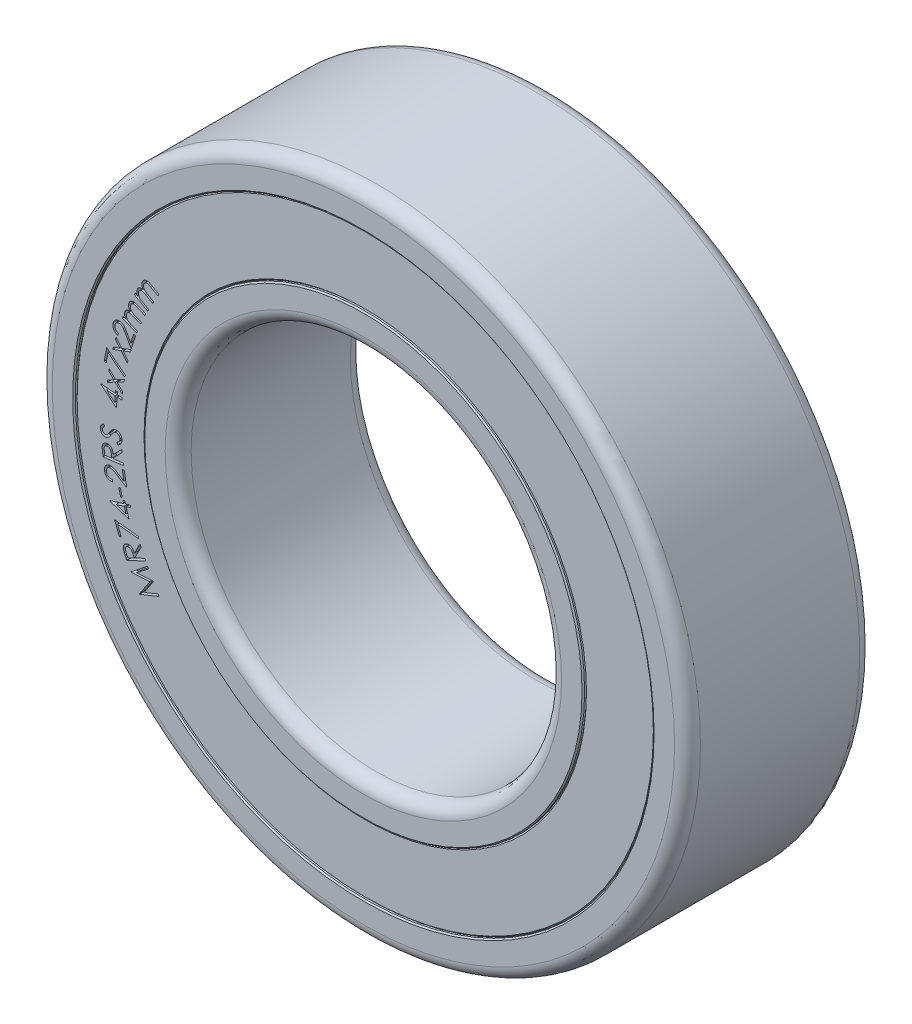
from build123d import *

# Parameters (mm, degrees)
SKETCH_R_INNER_BODY_W          = 2
SKETCH_R_INNER_BODY_H          = 0.375
FILLET_INNER_BODY_R            = 0.14
CHAMFER_INNER_BODY_SIZE        = 0.014
SKETCH_R_OUTER_BODY_W          = 2
SKETCH_R_OUTER_BODY_H          = 0.375
FILLET_OUTER_BODY_R            = 0.14
CHAMFER_OUTER_BODY_SIZE        = 0.014
SKETCH_R_SEAL_FACES_W          = 1.96
SKETCH_R_SEAL_FACES_H          = 0.75
CHAMFER_SEALS_SIZE             = 0.014
CUT_EXTRUDE_SEAL_LABEL_1_DEPTH = 0.05
CUT_EXTRUDE_SEAL_LABEL_2_DEPTH = 0.05


with BuildPart() as part:
    # Sketch R, INNER BODY → Revolve INNER BODY (revolve)
    with BuildSketch(Plane(origin=(0, 0, 0), x_dir=(0, 0, -1), z_dir=(1, 0, 0)), mode=Mode.PRIVATE) as revolve_inner_body_sk:
        with Locations((0, 2.1875)):
            Rectangle(SKETCH_R_INNER_BODY_W, SKETCH_R_INNER_BODY_H)
    revolve(revolve_inner_body_sk.sketch.rotate(Axis((0, 0, 17.5), (0, 0, -1)), 90), axis=Axis((0, 0, 17.5), (0, 0, -1)))

    # Fillet INNER BODY
    fillet_inner_body_edges = [part.edges().sort_by_distance(p)[0] for p in [
        (-2, 0, -1),
        (-2, 0, 1),
    ]]
    fillet(fillet_inner_body_edges, radius=FILLET_INNER_BODY_R)

    # Chamfer INNER BODY
    chamfer_inner_body_edges = [part.edges().sort_by_distance(p)[0] for p in [
        (-2.375, 0, 1),
        (-2.375, 0, -1),
    ]]
    chamfer(chamfer_inner_body_edges, length=CHAMFER_INNER_BODY_SIZE)


with BuildPart() as body_2:
    # Sketch R, OUTER BODY → Revolve OUTER BODY (revolve)
    with BuildSketch(Plane(origin=(0, 0, 0), x_dir=(0, 0, -1), z_dir=(1, 0, 0)), mode=Mode.PRIVATE) as revolve_outer_body_sk:
        with Locations((0, 3.3125)):
            Rectangle(SKETCH_R_OUTER_BODY_W, SKETCH_R_OUTER_BODY_H)
    revolve(revolve_outer_body_sk.sketch.rotate(Axis((0, 0, 17.5), (0, 0, -1)), 90), axis=Axis((0, 0, 17.5), (0, 0, -1)))

    # Fillet OUTER BODY
    fillet_outer_body_edges = [body_2.edges().sort_by_distance(p)[0] for p in [
        (-3.5, 0, 1),
        (-3.5, 0, -1),
    ]]
    fillet(fillet_outer_body_edges, radius=FILLET_OUTER_BODY_R)

    # Chamfer OUTER BODY
    chamfer_outer_body_edges = [body_2.edges().sort_by_distance(p)[0] for p in [
        (-3.125, 0, -1),
        (-3.125, 0, 1),
    ]]
    chamfer(chamfer_outer_body_edges, length=CHAMFER_OUTER_BODY_SIZE)


with BuildPart() as body_3:
    # Sketch R, SEAL FACES → Revolve SEALS (revolve)
    with BuildSketch(Plane(origin=(0, 0, 0), x_dir=(0, 0, -1), z_dir=(1, 0, 0)), mode=Mode.PRIVATE) as revolve_seals_sk:
        with Locations((0, 2.75)):
            Rectangle(SKETCH_R_SEAL_FACES_W, SKETCH_R_SEAL_FACES_H)
    revolve(revolve_seals_sk.sketch.rotate(Axis((0, 0, 17.5), (0, 0, -1)), 270), axis=Axis((0, 0, 17.5), (0, 0, -1)))

    # Chamfer SEALS
    chamfer_seals_edges = [body_3.edges().sort_by_distance(p)[0] for p in [
        (2.375, 0, -0.98),
        (2.375, 0, 0.98),
        (3.125, 0, 0.98),
        (3.125, 0, -0.98),
    ]]
    chamfer(chamfer_seals_edges, length=CHAMFER_SEALS_SIZE)

    # Sketch TEXT RADIUS 1 — MANUALLY ASSIGN TEXT AND FONT SIZE (FROM EQUATIONS) → Cut-Extrude SEAL LABEL 1 (cut)
    # profile 1 of 15: a face of its own
    with BuildSketch(Plane.XY.offset(0.98)):
        with BuildLine():
            Line((-2.493850259, 1.276849297), (-2.483393528, 1.295283792))
            Line((-2.483393528, 1.295283792), (-2.45851372, 1.281221292))
            add(Edge.make_bspline(
                [(-2.45851372, 1.281221292), (-2.459781311, 1.284025774), (-2.462212051, 1.289403664), (-2.464906597, 1.29746251), (-2.466794096, 1.305058576), (-2.467198836, 1.310028084), (-2.467392927, 1.312411196)],
                knots=[0, 0, 0, 0, 1.131092888, 2.168989886, 3.121944761, 4, 4, 4, 4], degree=3))
            add(Edge.make_bspline(
                [(-2.467392927, 1.312411196), (-2.46737645, 1.315483206), (-2.46734401, 1.321531698), (-2.465764338, 1.330389716), (-2.463226615, 1.33888625), (-2.460535831, 1.344101977), (-2.459189802, 1.346711075)],
                knots=[0, 0, 0, 0, 1.031242909, 2.030417538, 3.01474224, 4, 4, 4, 4], degree=3))
            add(Edge.make_bspline(
                [(-2.459189802, 1.346711075), (-2.458177608, 1.348405952), (-2.456160772, 1.35178306), (-2.452449175, 1.356339097), (-2.448448335, 1.360610333), (-2.443934595, 1.364292879), (-2.439212571, 1.367532756), (-2.434329205, 1.370157039), (-2.42936578, 1.372185358), (-2.424202816, 1.373559722), (-2.41866679, 1.374339696), (-2.412605767, 1.374432583), (-2.405928041, 1.373913034), (-2.401312428, 1.373159389), (-2.398883312, 1.372762758)],
                knots=[0, 0, 0, 0, 1.002515131, 1.997550882, 2.980934586, 3.973739049, 4.952661591, 5.889171434, 6.787155502, 7.672935777, 8.598822525, 9.622764541, 10.748902548, 12, 12, 12, 12], degree=3))
            add(Edge.make_bspline(
                [(-2.398883312, 1.372762758), (-2.40069129, 1.375862144), (-2.404209278, 1.381892969), (-2.408031335, 1.391411806), (-2.410644573, 1.40088771), (-2.411757734, 1.410366765), (-2.411584583, 1.419647673), (-2.410176778, 1.428642491), (-2.40754901, 1.437317985), (-2.404783072, 1.442676248), (-2.403390523, 1.445373936)],
                knots=[0, 0, 0, 0, 1.124456839, 2.187983171, 3.207901862, 4.200092288, 5.171301601, 6.11133126, 7.049124594, 8, 8, 8, 8], degree=3))
            add(Edge.make_bspline(
                [(-2.403390523, 1.445373936), (-2.401922957, 1.447748747), (-2.39904841, 1.452400328), (-2.393702136, 1.458484463), (-2.387694951, 1.463621315), (-2.38098204, 1.467678905), (-2.373780778, 1.470688665), (-2.366192224, 1.472650982), (-2.358265067, 1.473269293), (-2.351442434, 1.472911155), (-2.345740329, 1.471947794), (-2.341080681, 1.47082033), (-2.336126462, 1.469188492), (-2.330805608, 1.467290609), (-2.325208192, 1.464847541), (-2.319265992, 1.462063171), (-2.312998276, 1.458859006), (-2.308762024, 1.456504832), (-2.306575619, 1.455289801)],
                knots=[0, 0, 0, 0, 1.20782675, 2.365790568, 3.492654088, 4.620194244, 5.749330407, 6.863944224, 8.000784572, 9.180786799, 9.814311109, 10.504248448, 11.255656852, 12.073179121, 12.950986227, 13.90029122, 14.916303387, 16, 16, 16, 16], degree=3))
            Line((-2.306575619, 1.455289801), (-2.227924778, 1.410803624))
            Line((-2.227924778, 1.410803624), (-2.238606869, 1.391873335))
            Line((-2.238606869, 1.391873335), (-2.317257711, 1.436359513))
            add(Edge.make_bspline(
                [(-2.317257711, 1.436359513), (-2.31911736, 1.437402016), (-2.322682964, 1.439400862), (-2.327860412, 1.442181053), (-2.332697603, 1.444499308), (-2.337098989, 1.446551817), (-2.341114095, 1.448218134), (-2.34472155, 1.449570571), (-2.347973523, 1.450458642), (-2.351728028, 1.451262206), (-2.356174003, 1.451604292), (-2.361388321, 1.451131674), (-2.366526037, 1.449873573), (-2.371478782, 1.447720028), (-2.376197859, 1.444856107), (-2.380445265, 1.441122381), (-2.384369388, 1.436737221), (-2.386423133, 1.433303775), (-2.387480066, 1.431536797)],
                knots=[0, 0, 0, 0, 1.262663481, 2.420970895, 3.47952848, 4.439064805, 5.296691107, 6.053854326, 6.718764441, 7.291145796, 8.3264106, 9.344672673, 10.38054911, 11.444924628, 12.53149581, 13.635595505, 14.783190336, 16, 16, 16, 16], degree=3))
            add(Edge.make_bspline(
                [(-2.387480066, 1.431536797), (-2.388641554, 1.42927116), (-2.390939979, 1.424787778), (-2.392982236, 1.417480235), (-2.393953071, 1.409946867), (-2.393697593, 1.40224177), (-2.392363543, 1.394618501), (-2.38991082, 1.387250547), (-2.386275124, 1.380318146), (-2.382429874, 1.374808027), (-2.378610615, 1.3705032), (-2.375021524, 1.367148745), (-2.370802104, 1.363621468), (-2.365922653, 1.359952238), (-2.360445091, 1.356067534), (-2.354275134, 1.352125652), (-2.347510258, 1.347957306), (-2.342731239, 1.345210619), (-2.340244489, 1.343781388)],
                knots=[0, 0, 0, 0, 1.079922321, 2.137017666, 3.205625624, 4.298183218, 5.40066339, 6.485183712, 7.584885685, 8.717098164, 9.332326944, 10.02801545, 10.803205607, 11.669229558, 12.622509047, 13.657042577, 14.780848159, 16, 16, 16, 16], degree=3))
            Line((-2.340244489, 1.343781388), (-2.283859273, 1.31187033))
            Line((-2.283859273, 1.31187033), (-2.294270932, 1.293480907))
            Line((-2.294270932, 1.293480907), (-2.368008912, 1.335172614))
            add(Edge.make_bspline(
                [(-2.368008912, 1.335172614), (-2.370105968, 1.336356032), (-2.374111169, 1.338616262), (-2.379959343, 1.341679272), (-2.385299945, 1.344386231), (-2.390174281, 1.346710702), (-2.394604588, 1.348593155), (-2.398548522, 1.350172763), (-2.40207166, 1.351239855), (-2.406072522, 1.352236859), (-2.410756565, 1.352698995), (-2.416236928, 1.352457285), (-2.421568634, 1.351246919), (-2.426747916, 1.349261238), (-2.431613889, 1.346442503), (-2.43598218, 1.342731901), (-2.439987958, 1.33836067), (-2.442073894, 1.334913178), (-2.443144129, 1.333144369)],
                knots=[0, 0, 0, 0, 1.339914424, 2.559124168, 3.673365948, 4.671943087, 5.563374151, 6.352126626, 7.03443837, 7.610360597, 8.644461839, 9.640656071, 10.650890486, 11.672546562, 12.717909011, 13.76270292, 14.852106996, 16, 16, 16, 16], degree=3))
            add(Edge.make_bspline(
                [(-2.443144129, 1.333144369), (-2.444235518, 1.330980295), (-2.446414101, 1.326660465), (-2.448441593, 1.319616862), (-2.449308927, 1.312242707), (-2.44919065, 1.304653113), (-2.447931846, 1.297073419), (-2.44557015, 1.289732095), (-2.442076779, 1.282765955), (-2.438314545, 1.277250546), (-2.434627195, 1.272980013), (-2.431300834, 1.26966302), (-2.427414854, 1.266315241), (-2.4230336, 1.262849956), (-2.418159775, 1.259260364), (-2.412690704, 1.255699225), (-2.406738288, 1.251978976), (-2.402542347, 1.249566995), (-2.400370691, 1.248318648)],
                knots=[0, 0, 0, 0, 1.083100858, 2.162039186, 3.25973909, 4.396421224, 5.548417223, 6.686192943, 7.835044091, 9.025099153, 9.664068007, 10.358327412, 11.12569965, 11.958552509, 12.858404488, 13.833881641, 14.878901389, 16, 16, 16, 16], degree=3))
            Line((-2.400370691, 1.248318648), (-2.339343047, 1.213793407))
            Line((-2.339343047, 1.213793407), (-2.349799778, 1.195358912))
            Line((-2.349799778, 1.195358912), (-2.493850259, 1.276849297))
        make_face()
    # profile 2 of 15: a face of its own
    with BuildSketch(Plane.XY.offset(0.98)):
        with BuildLine():
            Line((-2.620630212, 0.992861495), (-2.612517231, 1.012467865))
            Line((-2.612517231, 1.012467865), (-2.586059899, 1.001515341))
            add(Edge.make_bspline(
                [(-2.586059899, 1.001515341), (-2.587669099, 1.004148817), (-2.590757777, 1.009203475), (-2.594462063, 1.016892105), (-2.597233164, 1.024244699), (-2.59824222, 1.029143625), (-2.598725164, 1.031488298)],
                knots=[0, 0, 0, 0, 1.13029279, 2.169469175, 3.12389057, 4, 4, 4, 4], degree=3))
            add(Edge.make_bspline(
                [(-2.598725164, 1.031488298), (-2.599084688, 1.034549411), (-2.59979217, 1.040573161), (-2.59930687, 1.049564661), (-2.597812301, 1.058323861), (-2.595750467, 1.063830601), (-2.594713745, 1.066599476)],
                knots=[0, 0, 0, 0, 1.032276483, 2.031344828, 3.010129257, 4, 4, 4, 4], degree=3))
            add(Edge.make_bspline(
                [(-2.594713745, 1.066599476), (-2.593912214, 1.068407669), (-2.592312146, 1.0720173), (-2.589214428, 1.077040572), (-2.585682359, 1.081733939), (-2.581688593, 1.085972902), (-2.57738396, 1.089765505), (-2.57284008, 1.092951468), (-2.568148266, 1.095590273), (-2.563171869, 1.097549172), (-2.557761993, 1.098986889), (-2.551739716, 1.099778942), (-2.545031171, 1.100170753), (-2.54034165, 1.099939253), (-2.537877808, 1.099817625)],
                knots=[0, 0, 0, 0, 1.002304304, 2.00086405, 2.985512948, 3.977595481, 4.949748592, 5.890630637, 6.787779438, 7.673690431, 8.596119573, 9.620008404, 10.749568814, 12, 12, 12, 12], degree=3))
            add(Edge.make_bspline(
                [(-2.537877808, 1.099817625), (-2.540056525, 1.102681661), (-2.544297969, 1.108257259), (-2.549264321, 1.117282834), (-2.552989318, 1.126426235), (-2.555282303, 1.135718078), (-2.556326448, 1.14497354), (-2.555905091, 1.154083472), (-2.554418413, 1.163051392), (-2.552291931, 1.168715153), (-2.551219154, 1.171572433)],
                knots=[0, 0, 0, 0, 1.124006177, 2.188172899, 3.210671756, 4.2031661, 5.1718331, 6.112230054, 7.04764943, 8, 8, 8, 8], degree=3))
            add(Edge.make_bspline(
                [(-2.551219154, 1.171572433), (-2.550060446, 1.174120783), (-2.547794452, 1.179104392), (-2.543207683, 1.1857962), (-2.537829819, 1.191597312), (-2.531678504, 1.196484038), (-2.524870529, 1.200365868), (-2.517525318, 1.203154459), (-2.509723205, 1.20475951), (-2.502905654, 1.205216228), (-2.497120049, 1.204968377), (-2.492343316, 1.204425723), (-2.487203293, 1.203450572), (-2.481686819, 1.202130422), (-2.475794203, 1.200456515), (-2.469519201, 1.198428354), (-2.462898976, 1.195981533), (-2.458395558, 1.194151364), (-2.456071918, 1.193207048)],
                knots=[0, 0, 0, 0, 1.208189108, 2.362760183, 3.488554911, 4.616351985, 5.744840633, 6.862910766, 7.997734681, 9.175737264, 9.806194994, 10.498960773, 11.251737967, 12.066087069, 12.950088575, 13.898886109, 14.915883417, 16, 16, 16, 16], degree=3))
            Line((-2.456071918, 1.193207048), (-2.372418072, 1.158546591))
            Line((-2.372418072, 1.158546591), (-2.380801486, 1.138399356))
            Line((-2.380801486, 1.138399356), (-2.464455332, 1.173059812))
            add(Edge.make_bspline(
                [(-2.464455332, 1.173059812), (-2.466437298, 1.173858793), (-2.470240956, 1.175392145), (-2.475729439, 1.177553955), (-2.480820207, 1.179268347), (-2.485442823, 1.180809747), (-2.489644336, 1.181962905), (-2.493413841, 1.182848916), (-2.496740881, 1.183404984), (-2.500569602, 1.183719538), (-2.505022302, 1.183451901), (-2.510165827, 1.182452834), (-2.51509786, 1.180496817), (-2.519765368, 1.177785957), (-2.524132081, 1.17438761), (-2.527884685, 1.170123523), (-2.531245434, 1.165254978), (-2.532887494, 1.161567827), (-2.533731173, 1.159673394)],
                knots=[0, 0, 0, 0, 1.261964876, 2.421880166, 3.482435277, 4.433552027, 5.298824819, 6.054240734, 6.719338187, 7.288870585, 8.319387899, 9.34246954, 10.370539793, 11.435760287, 12.522053119, 13.621346851, 14.77786421, 16, 16, 16, 16], degree=3))
            add(Edge.make_bspline(
                [(-2.533731173, 1.159673394), (-2.534613339, 1.157278045), (-2.53635971, 1.152536117), (-2.537460642, 1.145034904), (-2.537541958, 1.137440359), (-2.536346291, 1.129824576), (-2.534042184, 1.122414973), (-2.530756721, 1.115370496), (-2.52627164, 1.108938777), (-2.521800254, 1.103902975), (-2.517453851, 1.100111529), (-2.513484459, 1.097170206), (-2.508852226, 1.094179308), (-2.503556498, 1.091127057), (-2.497635342, 1.087967586), (-2.491056714, 1.084724461), (-2.483785205, 1.081443822), (-2.47868808, 1.079298193), (-2.476038865, 1.07818301)],
                knots=[0, 0, 0, 0, 1.080630435, 2.139258776, 3.197599115, 4.294024547, 5.395074159, 6.481612541, 7.577982364, 8.711034313, 9.329976466, 10.022349179, 10.805723069, 11.668481336, 12.615420282, 13.653264855, 14.780292042, 16, 16, 16, 16], degree=3))
            Line((-2.476038865, 1.07818301), (-2.41604788, 1.053303202))
            Line((-2.41604788, 1.053303202), (-2.424160861, 1.033741904))
            Line((-2.424160861, 1.033741904), (-2.502631414, 1.066238899))
            add(Edge.make_bspline(
                [(-2.502631414, 1.066238899), (-2.504852132, 1.067147417), (-2.509115505, 1.068891606), (-2.515271279, 1.071279443), (-2.520915512, 1.073328035), (-2.52606133, 1.074996321), (-2.53069106, 1.07634874), (-2.534800823, 1.077414935), (-2.538412528, 1.078118071), (-2.542508666, 1.078532404), (-2.547234795, 1.078470071), (-2.55263128, 1.077511111), (-2.557836629, 1.075734195), (-2.562698445, 1.073046878), (-2.567267348, 1.069705794), (-2.571138215, 1.065453749), (-2.574569404, 1.060592673), (-2.576233429, 1.056911876), (-2.577090548, 1.055015942)],
                knots=[0, 0, 0, 0, 1.332388689, 2.55794249, 3.66634919, 4.666302223, 5.56134869, 6.344444213, 7.023522319, 7.602150159, 8.628485546, 9.636653664, 10.633992892, 11.668064628, 12.710950538, 13.761649683, 14.847052953, 16, 16, 16, 16], degree=3))
            add(Edge.make_bspline(
                [(-2.577090548, 1.055015942), (-2.577914547, 1.052723025), (-2.579553443, 1.048162521), (-2.580720638, 1.040922186), (-2.580678758, 1.033493114), (-2.57960619, 1.025980682), (-2.577465705, 1.018583429), (-2.574176544, 1.011596314), (-2.569879696, 1.005073906), (-2.565464713, 1.000060035), (-2.561296715, 0.996238437), (-2.557562349, 0.993370378), (-2.553342325, 0.990430966), (-2.548524225, 0.987567006), (-2.543208453, 0.984654906), (-2.537391816, 0.981644213), (-2.53098187, 0.978759834), (-2.526522753, 0.976853406), (-2.524220957, 0.975869308)],
                knots=[0, 0, 0, 0, 1.086994363, 2.161981055, 3.256269169, 4.395575004, 5.542765402, 6.684047485, 7.832906381, 9.022111328, 9.658861104, 10.357186294, 11.124428159, 11.955700792, 12.860121355, 13.832919428, 14.881353375, 16, 16, 16, 16], degree=3))
            Line((-2.524220957, 0.975869308), (-2.459272039, 0.948961255))
            Line((-2.459272039, 0.948961255), (-2.467385019, 0.929354885))
            Line((-2.467385019, 0.929354885), (-2.620630212, 0.992861495))
        make_face()
    # profile 3 of 15: a face of its own
    with BuildSketch(Plane.XY.offset(0.98)):
        with BuildLine():
            Line((-2.665789728, 0.825945918), (-2.672505473, 0.805483177))
            add(Edge.make_bspline(
                [(-2.672505473, 0.805483177), (-2.675050629, 0.806456823), (-2.680038864, 0.808365066), (-2.687045026, 0.811999266), (-2.693586681, 0.815968214), (-2.699497047, 0.820550326), (-2.704860831, 0.82559915), (-2.709710644, 0.831097989), (-2.713961356, 0.837141468), (-2.71762131, 0.843596278), (-2.720693594, 0.850311189), (-2.723007067, 0.857217933), (-2.724587664, 0.864210879), (-2.725449444, 0.871292626), (-2.725598681, 0.878454065), (-2.724932067, 0.885697054), (-2.723600876, 0.893039458), (-2.722147497, 0.897863009), (-2.721408718, 0.900314908)],
                knots=[0, 0, 0, 0, 1.099440207, 2.154785707, 3.18169601, 4.185135222, 5.167879305, 6.15226959, 7.140242065, 8.145476635, 9.144542261, 10.117123647, 11.081058848, 12.034380046, 12.993013339, 13.967314754, 14.966748645, 16, 16, 16, 16], degree=3))
            add(Edge.make_bspline(
                [(-2.721408718, 0.900314908), (-2.720565563, 0.902691164), (-2.718908442, 0.907361411), (-2.715733683, 0.913932647), (-2.712125408, 0.919989155), (-2.707997117, 0.925456364), (-2.703442864, 0.930421669), (-2.698328191, 0.934763695), (-2.692789057, 0.938615308), (-2.686796361, 0.941831442), (-2.680564927, 0.944456399), (-2.674261657, 0.946560315), (-2.667903793, 0.947980905), (-2.661527113, 0.948672053), (-2.655126735, 0.948845743), (-2.648712565, 0.948271492), (-2.642261052, 0.947118467), (-2.638044774, 0.94584994), (-2.635906915, 0.945206735)],
                knots=[0, 0, 0, 0, 1.121331887, 2.203843392, 3.241512032, 4.253733539, 5.247234997, 6.23346623, 7.2330678, 8.244206822, 9.253775288, 10.239008907, 11.197683953, 12.146422817, 13.089325123, 14.042083736, 15.007241178, 16, 16, 16, 16], degree=3))
            add(Edge.make_bspline(
                [(-2.635906915, 0.945206735), (-2.632959272, 0.944125416), (-2.627110498, 0.94197984), (-2.618935688, 0.937431089), (-2.611406219, 0.931907633), (-2.60567885, 0.926414439), (-2.601266944, 0.921359994), (-2.597703524, 0.916961207), (-2.59403093, 0.911868623), (-2.590095117, 0.906216637), (-2.586066325, 0.899865958), (-2.58176722, 0.892952092), (-2.5773694, 0.885348711), (-2.574393112, 0.880065491), (-2.572851026, 0.877328129)],
                knots=[0, 0, 0, 0, 1.18729234, 2.355850084, 3.527712146, 4.714622878, 5.351416932, 6.067453049, 6.857053023, 7.72804454, 8.674780104, 9.704063049, 10.810420581, 12, 12, 12, 12], degree=3))
            Line((-2.572851026, 0.877328129), (-2.533007276, 0.805393033))
            Line((-2.533007276, 0.805393033), (-2.500600425, 0.903920677))
            Line((-2.500600425, 0.903920677), (-2.480002468, 0.89715986))
            Line((-2.480002468, 0.89715986), (-2.527688766, 0.752207937))
            Line((-2.527688766, 0.752207937), (-2.588941771, 0.862679692))
            add(Edge.make_bspline(
                [(-2.588941771, 0.862679692), (-2.590417878, 0.865375322), (-2.593251811, 0.87055058), (-2.597507583, 0.877894285), (-2.601476998, 0.884587727), (-2.605174182, 0.890602719), (-2.608681613, 0.895899443), (-2.611858962, 0.900554976), (-2.614806907, 0.904535536), (-2.618448776, 0.908817985), (-2.622974743, 0.913430389), (-2.628953393, 0.917962781), (-2.635380981, 0.921689339), (-2.639995235, 0.923424094), (-2.642307156, 0.924293273)],
                knots=[0, 0, 0, 0, 1.323824049, 2.54156903, 3.655919369, 4.676021252, 5.582487033, 6.392107017, 7.104003314, 7.714721723, 8.813019975, 9.879608548, 10.93760182, 12, 12, 12, 12], degree=3))
            add(Edge.make_bspline(
                [(-2.642307156, 0.924293273), (-2.64380129, 0.924746117), (-2.646740682, 0.92563699), (-2.651234894, 0.926402983), (-2.655704379, 0.926645807), (-2.660167183, 0.926565269), (-2.664595825, 0.925830444), (-2.669015229, 0.924769024), (-2.673405105, 0.923165409), (-2.677711794, 0.921113357), (-2.681848165, 0.918691241), (-2.685711884, 0.915933701), (-2.689213395, 0.912834556), (-2.692371878, 0.909407194), (-2.69515924, 0.905648262), (-2.697661738, 0.901575264), (-2.699779373, 0.897159098), (-2.700883644, 0.894045866), (-2.701441771, 0.89247236)],
                knots=[0, 0, 0, 0, 1.00258517, 1.972373425, 2.920289425, 3.876527078, 4.833690303, 5.798419387, 6.794007413, 7.830465642, 8.860383213, 9.870470858, 10.875887605, 11.85979788, 12.860009513, 13.878322651, 14.927651079, 16, 16, 16, 16], degree=3))
            add(Edge.make_bspline(
                [(-2.701441771, 0.89247236), (-2.701960589, 0.890799105), (-2.702981769, 0.887505663), (-2.703837144, 0.882477821), (-2.704324748, 0.877534729), (-2.704269999, 0.872656258), (-2.703750739, 0.867844532), (-2.702623942, 0.863132195), (-2.701105438, 0.858473091), (-2.699074686, 0.85392267), (-2.69654817, 0.849533958), (-2.69351253, 0.845404659), (-2.69007256, 0.841481051), (-2.686109005, 0.837866003), (-2.681681869, 0.8345096), (-2.676839202, 0.83132334), (-2.671511513, 0.828438899), (-2.667725872, 0.826789496), (-2.665789728, 0.825945918)],
                knots=[0, 0, 0, 0, 0.999848482, 1.967985665, 2.907541963, 3.834625024, 4.750312775, 5.666483188, 6.597531549, 7.546645746, 8.508062325, 9.48498785, 10.470137336, 11.48465341, 12.543936325, 13.641480151, 14.793748592, 16, 16, 16, 16], degree=3))
        make_face()
    # profile 4 of 15: a face of its own
    with BuildSketch(Plane.XY.offset(0.98)):
        Polygon((-2.726748591, 0.64742797), (-2.719942702, 0.672037345), (-2.64917948, 0.697863667), (-2.696550274, 0.756412345), (-2.689699312, 0.78102172), (-2.629122389, 0.705570999), (-2.528431283, 0.743747081), (-2.535327317, 0.718822201), (-2.615781043, 0.688623883), (-2.562190298, 0.622007297), (-2.568951115, 0.597533138), (-2.635883206, 0.68109684), align=None)
    # profile 5 of 15: a face of its own
    with BuildSketch(Plane.XY.offset(0.98)):
        Polygon((-2.817907509, 0.492213489), (-2.791540321, 0.631531397), (-2.588580586, 0.471480315), (-2.601290922, 0.45516421), (-2.777207388, 0.593535604), (-2.797129263, 0.488292214), align=None)
    # profile 6 of 15: a face of its own
    with BuildSketch(Plane.XY.offset(0.98)):
        Polygon((-2.785791088, 0.309545236), (-2.782050103, 0.334875765), (-2.714892651, 0.369310861), (-2.769249622, 0.421684659), (-2.765508637, 0.447015188), (-2.695827146, 0.379452087), (-2.600499622, 0.429887784), (-2.60428568, 0.40424175), (-2.680547699, 0.364262784), (-2.618979189, 0.304632375), (-2.622675103, 0.279482135), (-2.699568132, 0.354256774), align=None)
    # profile 7 of 15: a face of its own
    with BuildSketch(Plane.XY.offset(0.98)):
        Polygon((-2.854971725, 0.25744692), (-2.854611148, 0.261999203), (-2.698661629, 0.250550886), (-2.696678456, 0.277639227), (-2.675224129, 0.276061703), (-2.677207302, 0.248973362), (-2.625194081, 0.245142232), (-2.626861749, 0.222786463), (-2.67887497, 0.226617593), (-2.686717518, 0.119706535), align=None)
        Polygon((-2.700329297, 0.228195117), (-2.793583504, 0.235046078), (-2.705152013, 0.162344756), align=None, mode=Mode.SUBTRACT)
    # profile 8 of 15: a face of its own
    with BuildSketch(Plane.XY.offset(0.98)):
        with BuildLine():
            Line((-2.670205301, -0.218260351), (-2.682555061, -0.199825856))
            add(Edge.make_bspline(
                [(-2.682555061, -0.199825856), (-2.679726184, -0.198027282), (-2.674295892, -0.194574753), (-2.667043052, -0.188832126), (-2.66085611, -0.183025092), (-2.655905248, -0.177009101), (-2.652070027, -0.170874601), (-2.6494455, -0.16456285), (-2.647975845, -0.158083351), (-2.647951699, -0.153724076), (-2.647939676, -0.15155362)],
                knots=[0, 0, 0, 0, 1.288977202, 2.47431147, 3.553653038, 4.547646442, 5.463689283, 6.326751488, 7.166900263, 8, 8, 8, 8], degree=3))
            add(Edge.make_bspline(
                [(-2.647939676, -0.15155362), (-2.648103239, -0.149698692), (-2.648427037, -0.146026558), (-2.649730565, -0.140670359), (-2.651628497, -0.135514587), (-2.654196478, -0.130662201), (-2.6572255, -0.126153752), (-2.660739945, -0.122200574), (-2.664726038, -0.118918581), (-2.669053582, -0.116256587), (-2.673645482, -0.114247022), (-2.678361797, -0.1128204), (-2.683206646, -0.112071811), (-2.686459056, -0.112100869), (-2.688098931, -0.11211552)],
                knots=[0, 0, 0, 0, 1.070081675, 2.118400769, 3.160464599, 4.223716455, 5.269037694, 6.279059454, 7.255223629, 8.229242218, 9.192926508, 10.130993864, 11.057641226, 12, 12, 12, 12], degree=3))
            add(Edge.make_bspline(
                [(-2.688098931, -0.11211552), (-2.689960112, -0.112304462), (-2.693722307, -0.11268639), (-2.699221176, -0.114514242), (-2.704681463, -0.117115454), (-2.70801164, -0.11955371), (-2.709733546, -0.120814438)],
                knots=[0, 0, 0, 0, 0.945846711, 1.911936006, 2.920342772, 4, 4, 4, 4], degree=3))
            add(Edge.make_bspline(
                [(-2.709733546, -0.120814438), (-2.710977078, -0.121837713), (-2.713575048, -0.123975527), (-2.717420751, -0.127611321), (-2.721382782, -0.131844155), (-2.725544775, -0.136595814), (-2.729897017, -0.141884459), (-2.734333451, -0.147764081), (-2.738983962, -0.154160643), (-2.742075528, -0.158652752), (-2.743672849, -0.160973693)],
                knots=[0, 0, 0, 0, 0.732374126, 1.530067065, 2.405044217, 3.368718546, 4.402985482, 5.519671957, 6.718487627, 8, 8, 8, 8], degree=3))
            add(Edge.make_bspline(
                [(-2.743672849, -0.160973693), (-2.745253963, -0.163295422), (-2.748271433, -0.167726317), (-2.752768492, -0.173941791), (-2.756833891, -0.179528356), (-2.760596764, -0.184434669), (-2.764026237, -0.188656227), (-2.767170038, -0.192173155), (-2.769859555, -0.195113213), (-2.771694043, -0.196685094), (-2.772519003, -0.197391962)],
                knots=[0, 0, 0, 0, 1.447682655, 2.762824592, 3.953839479, 5.008577076, 5.949500068, 6.755903065, 7.440535407, 8, 8, 8, 8], degree=3))
            add(Edge.make_bspline(
                [(-2.772519003, -0.197391962), (-2.773797837, -0.198401404), (-2.776310139, -0.200384478), (-2.780264268, -0.20301957), (-2.784310182, -0.205286038), (-2.788503912, -0.207127892), (-2.792754463, -0.208681913), (-2.79713946, -0.209787562), (-2.801590711, -0.210646626), (-2.804621551, -0.210854388), (-2.806142801, -0.210958669)],
                knots=[0, 0, 0, 0, 1.059211578, 2.080848316, 3.086806111, 4.070936978, 5.056812415, 6.026086149, 7.009246472, 8, 8, 8, 8], degree=3))
            add(Edge.make_bspline(
                [(-2.806142801, -0.210958669), (-2.80853525, -0.210996622), (-2.813238469, -0.211071233), (-2.820175237, -0.210008974), (-2.826842204, -0.208187793), (-2.833158704, -0.205417616), (-2.839044738, -0.20184731), (-2.844394705, -0.19750441), (-2.849117686, -0.192388273), (-2.853212257, -0.186621089), (-2.856574738, -0.180322546), (-2.859061188, -0.173600694), (-2.86078698, -0.166581652), (-2.861194933, -0.161749432), (-2.861401215, -0.159306024)],
                knots=[0, 0, 0, 0, 1.019823463, 2.004829926, 2.983594551, 3.96301035, 4.938639082, 5.914246733, 6.894481134, 7.901723722, 8.925994301, 9.932603718, 10.954622973, 12, 12, 12, 12], degree=3))
            add(Edge.make_bspline(
                [(-2.861401215, -0.159306024), (-2.861447343, -0.156702708), (-2.861539019, -0.151528763), (-2.860326293, -0.143865546), (-2.858267478, -0.13640435), (-2.85566882, -0.13039276), (-2.853076432, -0.125612903), (-2.850611397, -0.121987292), (-2.847801523, -0.118269133), (-2.844589284, -0.114470069), (-2.840940482, -0.110627265), (-2.836906403, -0.106676928), (-2.832459086, -0.102690155), (-2.829303672, -0.100070865), (-2.827687272, -0.098729101)],
                knots=[0, 0, 0, 0, 1.294278671, 2.572305469, 3.846516926, 5.140190106, 5.823207123, 6.551469898, 7.320510154, 8.143304903, 9.027094145, 9.95815567, 10.954040317, 12, 12, 12, 12], degree=3))
            Line((-2.827687272, -0.098729101), (-2.812903618, -0.116262154))
            add(Edge.make_bspline(
                [(-2.812903618, -0.116262154), (-2.814187943, -0.117350588), (-2.816681287, -0.119463639), (-2.820166327, -0.12265396), (-2.823338601, -0.125672706), (-2.82616232, -0.128551476), (-2.828566437, -0.131359161), (-2.830732127, -0.133959654), (-2.832472145, -0.136476278), (-2.834351152, -0.139585859), (-2.836063636, -0.143528379), (-2.837552659, -0.148374488), (-2.838274635, -0.153439565), (-2.838247756, -0.156855383), (-2.838234147, -0.15858487)],
                knots=[0, 0, 0, 0, 1.178560336, 2.288018087, 3.307243934, 4.244527516, 5.109364208, 5.89460939, 6.612426619, 7.249218838, 8.435778703, 9.610530776, 10.790170229, 12, 12, 12, 12], degree=3))
            add(Edge.make_bspline(
                [(-2.838234147, -0.15858487), (-2.838024712, -0.160746463), (-2.837620582, -0.164917522), (-2.835780814, -0.17082459), (-2.832914153, -0.176052964), (-2.829055306, -0.180468986), (-2.82451783, -0.183993392), (-2.819460873, -0.186478368), (-2.813959691, -0.187915878), (-2.810162677, -0.187893313), (-2.808216118, -0.187881745)],
                knots=[0, 0, 0, 0, 1.109336203, 2.140601238, 3.142223753, 4.139823434, 5.121166883, 6.063499614, 7.007243281, 8, 8, 8, 8], degree=3))
            add(Edge.make_bspline(
                [(-2.808216118, -0.187881745), (-2.807010427, -0.187790055), (-2.804592906, -0.187606207), (-2.801043583, -0.186816744), (-2.797578449, -0.185668467), (-2.794120865, -0.18417141), (-2.7906533, -0.182099943), (-2.787133634, -0.179391806), (-2.783473102, -0.176089057), (-2.781108958, -0.17356763), (-2.779865758, -0.172241721)],
                knots=[0, 0, 0, 0, 0.870058011, 1.744546559, 2.610354271, 3.497077743, 4.452890175, 5.511266273, 6.691283815, 8, 8, 8, 8], degree=3))
            add(Edge.make_bspline(
                [(-2.779865758, -0.172241721), (-2.779457193, -0.171748269), (-2.778481333, -0.170569655), (-2.776871537, -0.168450953), (-2.774874161, -0.165659384), (-2.772474032, -0.162231063), (-2.7696586, -0.158148365), (-2.766475747, -0.153419016), (-2.762854681, -0.148050621), (-2.76033144, -0.144238965), (-2.758997368, -0.142223693)],
                knots=[0, 0, 0, 0, 0.420391298, 1.004106212, 1.745672311, 2.672941217, 3.750476937, 5.000191008, 6.413961442, 8, 8, 8, 8], degree=3))
            add(Edge.make_bspline(
                [(-2.758997368, -0.142223693), (-2.757376294, -0.139793347), (-2.754232523, -0.135080147), (-2.749396841, -0.128424763), (-2.744726632, -0.122308872), (-2.740109992, -0.116817173), (-2.735686617, -0.111845538), (-2.731328672, -0.1074918), (-2.727115357, -0.103694553), (-2.721708771, -0.099483151), (-2.714968798, -0.095155285), (-2.706644974, -0.09135664), (-2.698271558, -0.088707225), (-2.692579079, -0.088174833), (-2.689766599, -0.087911794)],
                knots=[0, 0, 0, 0, 1.150958318, 2.232067756, 3.240874531, 4.182242568, 5.05830323, 5.861992996, 6.608255266, 7.291516722, 8.56096504, 9.752950229, 10.889801237, 12, 12, 12, 12], degree=3))
            add(Edge.make_bspline(
                [(-2.689766599, -0.087911794), (-2.687766908, -0.087867746), (-2.683817844, -0.08778076), (-2.677963429, -0.088418627), (-2.672254951, -0.089505965), (-2.66673187, -0.091295606), (-2.661385141, -0.093650284), (-2.65622204, -0.096600031), (-2.651246042, -0.100155718), (-2.646463096, -0.104209504), (-2.642062665, -0.10872166), (-2.638080378, -0.11350599), (-2.634747019, -0.118636605), (-2.631934761, -0.124022866), (-2.629660534, -0.129698665), (-2.627972923, -0.135652687), (-2.626747699, -0.141878403), (-2.626454376, -0.146139382), (-2.626305061, -0.148308428)],
                knots=[0, 0, 0, 0, 0.985861131, 1.946915505, 2.8990959, 3.848502444, 4.804340045, 5.777072232, 6.776632108, 7.817816492, 8.866153252, 9.882637779, 10.883872812, 11.878500778, 12.876437745, 13.894623548, 14.928260619, 16, 16, 16, 16], degree=3))
            add(Edge.make_bspline(
                [(-2.626305061, -0.148308428), (-2.626248363, -0.14999128), (-2.626135908, -0.153329126), (-2.626435996, -0.158283464), (-2.627008784, -0.163150797), (-2.627953804, -0.167913615), (-2.629256294, -0.172574057), (-2.630962768, -0.177104412), (-2.632918967, -0.181567994), (-2.635285684, -0.185924178), (-2.638056628, -0.190190132), (-2.641275861, -0.194384712), (-2.644924972, -0.198536095), (-2.649076279, -0.202603511), (-2.653655885, -0.206666321), (-2.658757876, -0.210598987), (-2.664292922, -0.21450795), (-2.668195951, -0.21698508), (-2.670205301, -0.218260351)],
                knots=[0, 0, 0, 0, 0.925909855, 1.83649222, 2.727429511, 3.620626173, 4.505098389, 5.386436569, 6.28192505, 7.184367631, 8.110609479, 9.077735738, 10.090920599, 11.148837746, 12.273220722, 13.457068985, 14.690852731, 16, 16, 16, 16], degree=3))
        make_face()
    # profile 9 of 15: a face of its own
    with BuildSketch(Plane.XY.offset(0.98)):
        with BuildLine():
            Line((-2.831070322, -0.410240417), (-2.836974769, -0.366069744))
            add(Edge.make_bspline(
                [(-2.836974769, -0.366069744), (-2.837354632, -0.363110584), (-2.838081153, -0.357450942), (-2.839055809, -0.34932678), (-2.839747387, -0.341928177), (-2.840366299, -0.335262437), (-2.840746864, -0.32931001), (-2.840849897, -0.324094012), (-2.840919405, -0.319610942), (-2.840717691, -0.316880483), (-2.84062561, -0.315634047)],
                knots=[0, 0, 0, 0, 1.41390786, 2.704217313, 3.877456621, 4.935287826, 5.876864661, 6.703071663, 7.407960913, 8, 8, 8, 8], degree=3))
            add(Edge.make_bspline(
                [(-2.84062561, -0.315634047), (-2.840448932, -0.313960955), (-2.840100964, -0.310665808), (-2.83900122, -0.305860191), (-2.837692992, -0.30121631), (-2.835944237, -0.296786295), (-2.83393282, -0.292508515), (-2.831484738, -0.288470163), (-2.828704883, -0.284603343), (-2.825620457, -0.280922503), (-2.822205811, -0.277504768), (-2.818509939, -0.27441704), (-2.814496525, -0.27175962), (-2.810257196, -0.269398872), (-2.805727985, -0.267413536), (-2.800944013, -0.265803711), (-2.795899255, -0.264510207), (-2.792419297, -0.263981302), (-2.790640634, -0.26371097)],
                knots=[0, 0, 0, 0, 1.030886406, 2.030326234, 3.018832625, 3.98733908, 4.947614016, 5.914716837, 6.878742085, 7.86621726, 8.856568562, 9.838136468, 10.814370316, 11.804207105, 12.810883979, 13.842387892, 14.89720994, 16, 16, 16, 16], degree=3))
            add(Edge.make_bspline(
                [(-2.790640634, -0.26371097), (-2.78769871, -0.263418748), (-2.781952244, -0.262847952), (-2.773425102, -0.263388753), (-2.765286765, -0.264971644), (-2.757639778, -0.267820021), (-2.750494376, -0.271625392), (-2.7440958, -0.276620086), (-2.738393057, -0.282596515), (-2.734328001, -0.288394268), (-2.73140968, -0.29355798), (-2.729386515, -0.297901728), (-2.727555701, -0.302655334), (-2.72583222, -0.307792583), (-2.724323437, -0.31335364), (-2.722918412, -0.319302187), (-2.721701173, -0.325663423), (-2.721062155, -0.330054363), (-2.720733783, -0.332310729)],
                knots=[0, 0, 0, 0, 1.272770841, 2.486105917, 3.668745269, 4.834735956, 5.991134011, 7.145498582, 8.318323774, 9.540392887, 10.1871432, 10.873881932, 11.604000669, 12.382346611, 13.208922913, 14.087178428, 15.017060906, 16, 16, 16, 16], degree=3))
            Line((-2.720733783, -0.332310729), (-2.628290875, -0.238831162))
            Line((-2.628290875, -0.238831162), (-2.624640033, -0.26628008))
            Line((-2.624640033, -0.26628008), (-2.717128014, -0.359579359))
            Line((-2.717128014, -0.359579359), (-2.715415274, -0.372244624))
            Line((-2.715415274, -0.372244624), (-2.612335346, -0.358497628))
            Line((-2.612335346, -0.358497628), (-2.609360586, -0.380673109))
            Line((-2.609360586, -0.380673109), (-2.831070322, -0.410240417))
        make_face()
        with BuildLine():
            Line((-2.812320322, -0.385180321), (-2.736959745, -0.375129239))
            Line((-2.736959745, -0.375129239), (-2.741782461, -0.336953157))
            add(Edge.make_bspline(
                [(-2.741782461, -0.336953157), (-2.742026704, -0.335163615), (-2.742497759, -0.33171225), (-2.743360968, -0.326737759), (-2.744295518, -0.322150387), (-2.745326144, -0.31793748), (-2.746469188, -0.314113175), (-2.747593619, -0.310623695), (-2.748929097, -0.307558882), (-2.750694809, -0.303961202), (-2.753292534, -0.300010268), (-2.757006175, -0.295943284), (-2.761225952, -0.292486869), (-2.766032036, -0.289893701), (-2.771117523, -0.287857868), (-2.776477858, -0.286715833), (-2.782004095, -0.286265442), (-2.785698932, -0.286611906), (-2.78757573, -0.286787893)],
                knots=[0, 0, 0, 0, 1.119443569, 2.158992007, 3.128793973, 4.020953071, 4.846046466, 5.602887539, 6.291323211, 6.916027573, 8.086077332, 9.206759738, 10.319365047, 11.449103542, 12.578381357, 13.703620186, 14.833550574, 16, 16, 16, 16], degree=3))
            add(Edge.make_bspline(
                [(-2.78757573, -0.286787893), (-2.789393803, -0.287088468), (-2.792983777, -0.287681984), (-2.798064067, -0.289610547), (-2.802833474, -0.292132205), (-2.8071131, -0.29543339), (-2.810892528, -0.299226032), (-2.814006862, -0.303482071), (-2.816422089, -0.30811324), (-2.817813774, -0.312312827), (-2.818618182, -0.315970057), (-2.818928575, -0.319144209), (-2.819168193, -0.322691188), (-2.819197069, -0.326632933), (-2.819056, -0.33096252), (-2.818734155, -0.335682219), (-2.818235803, -0.340792307), (-2.817783707, -0.344316064), (-2.817548687, -0.346147869)],
                knots=[0, 0, 0, 0, 1.163548242, 2.297547097, 3.42061163, 4.567294544, 5.703523331, 6.798919016, 7.891836053, 8.995289854, 9.588298846, 10.258187103, 11.010817361, 11.83806287, 12.751270783, 13.751820649, 14.831296515, 16, 16, 16, 16], degree=3))
            Line((-2.817548687, -0.346147869), (-2.812320322, -0.385180321))
        make_face(mode=Mode.SUBTRACT)
    # profile 10 of 15: a face of its own
    with BuildSketch(Plane.XY.offset(0.98)):
        with BuildLine():
            Line((-2.730763382, -0.572246538), (-2.726751964, -0.593295216))
            add(Edge.make_bspline(
                [(-2.726751964, -0.593295216), (-2.729436388, -0.593676907), (-2.734697428, -0.594424961), (-2.74253065, -0.594658476), (-2.750123069, -0.594288986), (-2.757464341, -0.5931319), (-2.764592606, -0.591405969), (-2.771433942, -0.588883525), (-2.778057982, -0.585723056), (-2.784353791, -0.581863602), (-2.790252261, -0.577455626), (-2.795625, -0.572595128), (-2.800408305, -0.567295595), (-2.804517277, -0.561508499), (-2.808102807, -0.555337506), (-2.811019303, -0.548706), (-2.813409442, -0.54168214), (-2.814465523, -0.536787594), (-2.815003166, -0.534295817)],
                knots=[0, 0, 0, 0, 1.099722419, 2.15527912, 3.175092391, 4.180659299, 5.167112048, 6.147059977, 7.134379309, 8.141479615, 9.139083312, 10.119012269, 11.07763108, 12.030335798, 12.99467822, 13.969204095, 14.966136658, 16, 16, 16, 16], degree=3))
            add(Edge.make_bspline(
                [(-2.815003166, -0.534295817), (-2.815404503, -0.531807061), (-2.816189436, -0.526939557), (-2.81665566, -0.519696941), (-2.816388343, -0.512704558), (-2.815425064, -0.505960975), (-2.813879572, -0.499430004), (-2.811537057, -0.493171443), (-2.808561719, -0.487150231), (-2.804909774, -0.481467845), (-2.80077346, -0.476173189), (-2.796284795, -0.471336864), (-2.791408869, -0.467066434), (-2.78624147, -0.463324945), (-2.780732707, -0.460127533), (-2.774885564, -0.457540552), (-2.768738648, -0.455352938), (-2.764445353, -0.454440091), (-2.762268791, -0.453977307)],
                knots=[0, 0, 0, 0, 1.127351549, 2.204872253, 3.240751551, 4.252136426, 5.248195549, 6.237062487, 7.235024736, 8.247481089, 9.253177061, 10.237556619, 11.194853332, 12.14810656, 13.087683726, 14.038350553, 15.005506884, 16, 16, 16, 16], degree=3))
            add(Edge.make_bspline(
                [(-2.762268791, -0.453977307), (-2.759181095, -0.453502604), (-2.753044876, -0.45255922), (-2.743738493, -0.452638187), (-2.734508692, -0.45372263), (-2.726884544, -0.455751429), (-2.720584765, -0.457971935), (-2.715378443, -0.460154751), (-2.709698873, -0.462776007), (-2.703570691, -0.465851203), (-2.696991979, -0.469374886), (-2.689942684, -0.473354889), (-2.682434534, -0.477812054), (-2.677302342, -0.480996543), (-2.674648599, -0.482643173)],
                knots=[0, 0, 0, 0, 1.187012379, 2.358964917, 3.528251211, 4.71516722, 5.351613729, 6.06929939, 6.862272931, 7.731533696, 8.677839371, 9.701776621, 10.811639259, 12, 12, 12, 12], degree=3))
            Line((-2.674648599, -0.482643173), (-2.605237541, -0.52604762))
            Line((-2.605237541, -0.52604762), (-2.624528406, -0.424680432))
            Line((-2.624528406, -0.424680432), (-2.603344512, -0.420623942))
            Line((-2.603344512, -0.420623942), (-2.57494908, -0.569767572))
            Line((-2.57494908, -0.569767572), (-2.681544632, -0.503105913))
            add(Edge.make_bspline(
                [(-2.681544632, -0.503105913), (-2.684124021, -0.501490668), (-2.689096846, -0.498376623), (-2.696325426, -0.494020721), (-2.70301567, -0.490135806), (-2.709128944, -0.48669199), (-2.714729419, -0.483764531), (-2.719752749, -0.481274736), (-2.724245071, -0.479265283), (-2.729439624, -0.477233565), (-2.735638068, -0.475474931), (-2.743006818, -0.474319242), (-2.750420836, -0.474192574), (-2.755273659, -0.474926812), (-2.757716507, -0.475296418)],
                knots=[0, 0, 0, 0, 1.317861515, 2.540716502, 3.654336319, 4.667911393, 5.578751729, 6.390522668, 7.095348305, 7.709107687, 8.804718359, 9.877570042, 10.93159586, 12, 12, 12, 12], degree=3))
            add(Edge.make_bspline(
                [(-2.757716507, -0.475296418), (-2.759226934, -0.475626551), (-2.762214429, -0.476279525), (-2.766507609, -0.477778595), (-2.770537525, -0.479697406), (-2.77437259, -0.481947785), (-2.777914807, -0.484669605), (-2.781254207, -0.487762208), (-2.784295115, -0.491285562), (-2.787087063, -0.495137497), (-2.789478511, -0.499260731), (-2.791556044, -0.503499471), (-2.79307195, -0.507895978), (-2.79417714, -0.512405675), (-2.79479532, -0.517029396), (-2.794972918, -0.521767018), (-2.794713366, -0.526613912), (-2.794180644, -0.529852475), (-2.793909416, -0.531501346)],
                knots=[0, 0, 0, 0, 0.997271521, 1.972517504, 2.926856145, 3.874817791, 4.836811677, 5.804264281, 6.80774002, 7.835841186, 8.870325302, 9.880944637, 10.877697396, 11.865541937, 12.873552496, 13.8828217, 14.922067303, 16, 16, 16, 16], degree=3))
            add(Edge.make_bspline(
                [(-2.793909416, -0.531501346), (-2.79353174, -0.533206266), (-2.792788096, -0.536563247), (-2.791208576, -0.541399669), (-2.789222291, -0.545932295), (-2.78682489, -0.550150633), (-2.784002194, -0.554053996), (-2.780798075, -0.557659098), (-2.777215057, -0.560978954), (-2.773238032, -0.563944828), (-2.768941099, -0.566570981), (-2.76429257, -0.568672821), (-2.759400976, -0.570418436), (-2.754197491, -0.571644712), (-2.74873173, -0.572535162), (-2.74298279, -0.572844299), (-2.736957041, -0.572831452), (-2.732864988, -0.572445009), (-2.730763382, -0.572246538)],
                knots=[0, 0, 0, 0, 1.001512571, 1.971974593, 2.913758138, 3.836491242, 4.750404229, 5.672452559, 6.599684476, 7.547915976, 8.514772459, 9.482896245, 10.469834333, 11.490128163, 12.545963696, 13.642909954, 14.789440446, 16, 16, 16, 16], degree=3))
        make_face()
    # profile 11 of 15: a face of its own
    with BuildSketch(Plane.XY.offset(0.98)):
        Polygon((-2.641579049, -0.69222653), (-2.66141078, -0.610871362), (-2.643336861, -0.606454294), (-2.623505131, -0.687809463), align=None)
    # profile 12 of 15: a face of its own
    with BuildSketch(Plane.XY.offset(0.98)):
        Polygon((-2.756904289, -0.786948357), (-2.758301524, -0.782621434), (-2.609608615, -0.736016867), (-2.617676524, -0.710190544), (-2.597213784, -0.703790304), (-2.589145875, -0.729616626), (-2.539521476, -0.714066746), (-2.532805731, -0.735385857), (-2.58243013, -0.750935737), (-2.550474, -0.852933934), align=None)
        Polygon((-2.60289287, -0.757335977), (-2.691820154, -0.785190544), (-2.583241428, -0.820166506), align=None, mode=Mode.SUBTRACT)
    # profile 13 of 15: a face of its own
    with BuildSketch(Plane.XY.offset(0.98)):
        Polygon((-2.655062242, -1.067814022), (-2.706805031, -0.935076642), (-2.448631954, -0.963381931), (-2.450750343, -0.984070032), (-2.674353108, -0.959821233), (-2.635275584, -1.06010669), align=None)
    # profile 14 of 15: a face of its own
    with BuildSketch(Plane.XY.offset(0.98)):
        with BuildLine():
            Line((-2.573949015, -1.249310474), (-2.592924375, -1.208880787))
            add(Edge.make_bspline(
                [(-2.592924375, -1.208880787), (-2.594176115, -1.206178637), (-2.596583944, -1.200980817), (-2.59996025, -1.19349471), (-2.602907317, -1.186627775), (-2.605403349, -1.180405366), (-2.607633988, -1.174865544), (-2.609295631, -1.16990754), (-2.610725595, -1.165637994), (-2.61134637, -1.162957194), (-2.611629303, -1.161735354)],
                knots=[0, 0, 0, 0, 1.407028082, 2.706540429, 3.880029766, 4.9372076, 5.874453054, 6.700568515, 7.407752693, 8, 8, 8, 8], degree=3))
            add(Edge.make_bspline(
                [(-2.611629303, -1.161735354), (-2.611964456, -1.160087652), (-2.61262773, -1.156826818), (-2.61300742, -1.151902286), (-2.61321238, -1.147067649), (-2.612845136, -1.142306959), (-2.612218079, -1.137604568), (-2.611034675, -1.133013983), (-2.609622561, -1.128452679), (-2.607719662, -1.124030288), (-2.605471799, -1.119742843), (-2.602873902, -1.115679022), (-2.599855052, -1.111915529), (-2.596519455, -1.10839081), (-2.592803566, -1.105115662), (-2.588675004, -1.102178659), (-2.58427331, -1.099375922), (-2.58110227, -1.097837605), (-2.579492885, -1.097056869)],
                knots=[0, 0, 0, 0, 1.028026268, 2.034484461, 3.018730361, 3.986342849, 4.952512542, 5.918157048, 6.883582641, 7.872413529, 8.859532895, 9.844036463, 10.819091062, 11.807708172, 12.811095515, 13.844740015, 14.906149133, 16, 16, 16, 16], degree=3))
            add(Edge.make_bspline(
                [(-2.579492885, -1.097056869), (-2.576771659, -1.095881179), (-2.571444258, -1.093579506), (-2.563126422, -1.091527655), (-2.554873077, -1.09062545), (-2.546717231, -1.091008249), (-2.538756378, -1.092509816), (-2.531120095, -1.09530912), (-2.523903533, -1.099350091), (-2.518220035, -1.103619002), (-2.513907137, -1.107719571), (-2.510645258, -1.111249964), (-2.507451794, -1.115245614), (-2.504262738, -1.119652366), (-2.501099399, -1.124492598), (-2.497994574, -1.129775899), (-2.494931298, -1.135514201), (-2.492971871, -1.139523483), (-2.491962837, -1.141588119)],
                knots=[0, 0, 0, 0, 1.272525897, 2.49125041, 3.66671169, 4.830438572, 5.988199611, 7.136517947, 8.310256756, 9.532262838, 10.181040121, 10.866644323, 11.596942839, 12.378561176, 13.20440067, 14.081700887, 15.012145433, 16, 16, 16, 16], degree=3))
            Line((-2.491962837, -1.141588119), (-2.431791563, -1.024265402))
            Line((-2.431791563, -1.024265402), (-2.419982668, -1.049415643))
            Line((-2.419982668, -1.049415643), (-2.480289159, -1.166558071))
            Line((-2.480289159, -1.166558071), (-2.474835433, -1.178141604))
            Line((-2.474835433, -1.178141604), (-2.380409351, -1.133880787))
            Line((-2.380409351, -1.133880787), (-2.370899135, -1.154163239))
            Line((-2.370899135, -1.154163239), (-2.573949015, -1.249310474))
        make_face()
        with BuildLine():
            Line((-2.563582428, -1.219698095), (-2.494577019, -1.187381388))
            Line((-2.494577019, -1.187381388), (-2.510667765, -1.152315282))
            add(Edge.make_bspline(
                [(-2.510667765, -1.152315282), (-2.511438442, -1.150687504), (-2.512933796, -1.147529106), (-2.515272827, -1.143038873), (-2.517581901, -1.138926126), (-2.519801989, -1.135190582), (-2.52204482, -1.131862319), (-2.524224708, -1.12890151), (-2.526383107, -1.126317294), (-2.529187995, -1.123449111), (-2.532842326, -1.120463745), (-2.537590948, -1.117657224), (-2.542696997, -1.115700993), (-2.548071046, -1.114603709), (-2.553550119, -1.114222574), (-2.559030307, -1.114693405), (-2.564453295, -1.115934665), (-2.567883169, -1.117405112), (-2.569622092, -1.118150619)],
                knots=[0, 0, 0, 0, 1.112777181, 2.15913517, 3.127556647, 4.027095076, 4.843301105, 5.606410871, 6.298200247, 6.92185282, 8.08321378, 9.202516211, 10.316261075, 11.445108906, 12.580123894, 13.698000976, 14.832902062, 16, 16, 16, 16], degree=3))
            add(Edge.make_bspline(
                [(-2.569622092, -1.118150619), (-2.57126371, -1.118982664), (-2.574504335, -1.120625158), (-2.578747034, -1.12402537), (-2.582568867, -1.127855223), (-2.585659691, -1.132313755), (-2.588158078, -1.137075256), (-2.589899449, -1.142070397), (-2.59080529, -1.147227185), (-2.590896383, -1.15166733), (-2.590468737, -1.15539776), (-2.589856036, -1.158539236), (-2.589008941, -1.162006744), (-2.587811598, -1.165785587), (-2.586365206, -1.169887774), (-2.584654061, -1.174314415), (-2.582612935, -1.179037643), (-2.581122301, -1.182276323), (-2.580349255, -1.183955907)],
                knots=[0, 0, 0, 0, 1.158497109, 2.286923773, 3.413317199, 4.562895319, 5.695139351, 6.798553435, 7.886584885, 8.986571956, 9.58756579, 10.253281047, 11.005233487, 11.838935736, 12.753518978, 13.750086852, 14.833191218, 16, 16, 16, 16], degree=3))
            Line((-2.580349255, -1.183955907), (-2.563582428, -1.219698095))
        make_face(mode=Mode.SUBTRACT)
    # profile 15 of 15: a face of its own
    with BuildSketch(Plane.XY.offset(0.98)):
        Polygon((-2.225887041, -1.413346186), (-2.436554109, -1.497631041), (-2.438356993, -1.494475993), (-2.324144253, -1.323427315), (-2.528951945, -1.336903878), (-2.530799902, -1.333703758), (-2.352088964, -1.193844984), (-2.341046296, -1.213045705), (-2.469366609, -1.312204359), (-2.290520455, -1.30093633), (-2.287680911, -1.30584919), (-2.387921296, -1.456299912), (-2.236704349, -1.394551114), align=None)
    extrude(amount=-CUT_EXTRUDE_SEAL_LABEL_1_DEPTH, mode=Mode.SUBTRACT)

    # Sketch TEXT RADIUS 2 — MANUALLY ASSIGN TEXT AND FONT SIZE (FROM EQUATIONS) → Cut-Extrude SEAL LABEL 2 (cut)
    # profile 1 of 15: a face of its own
    with BuildSketch(Plane(origin=(0, 0, -0.98), x_dir=(-1, 0, 0), z_dir=(0, 0, -1))):
        with BuildLine():
            Line((-2.493850259, 1.276849297), (-2.483393528, 1.295283792))
            Line((-2.483393528, 1.295283792), (-2.45851372, 1.281221292))
            add(Edge.make_bspline(
                [(-2.45851372, 1.281221292), (-2.459781311, 1.284025774), (-2.462212051, 1.289403664), (-2.464906597, 1.29746251), (-2.466794096, 1.305058576), (-2.467198836, 1.310028084), (-2.467392927, 1.312411196)],
                knots=[0, 0, 0, 0, 1.131092888, 2.168989886, 3.121944761, 4, 4, 4, 4], degree=3))
            add(Edge.make_bspline(
                [(-2.467392927, 1.312411196), (-2.46737645, 1.315483206), (-2.46734401, 1.321531698), (-2.465764338, 1.330389716), (-2.463226615, 1.33888625), (-2.460535831, 1.344101977), (-2.459189802, 1.346711075)],
                knots=[0, 0, 0, 0, 1.031242909, 2.030417538, 3.01474224, 4, 4, 4, 4], degree=3))
            add(Edge.make_bspline(
                [(-2.459189802, 1.346711075), (-2.458177608, 1.348405952), (-2.456160772, 1.35178306), (-2.452449175, 1.356339097), (-2.448448335, 1.360610333), (-2.443934595, 1.364292879), (-2.439212571, 1.367532756), (-2.434329205, 1.370157039), (-2.42936578, 1.372185358), (-2.424202816, 1.373559722), (-2.41866679, 1.374339696), (-2.412605767, 1.374432583), (-2.405928041, 1.373913034), (-2.401312428, 1.373159389), (-2.398883312, 1.372762758)],
                knots=[0, 0, 0, 0, 1.002515131, 1.997550882, 2.980934586, 3.973739049, 4.952661591, 5.889171434, 6.787155502, 7.672935777, 8.598822525, 9.622764541, 10.748902548, 12, 12, 12, 12], degree=3))
            add(Edge.make_bspline(
                [(-2.398883312, 1.372762758), (-2.40069129, 1.375862144), (-2.404209278, 1.381892969), (-2.408031335, 1.391411806), (-2.410644573, 1.40088771), (-2.411757734, 1.410366765), (-2.411584583, 1.419647673), (-2.410176778, 1.428642491), (-2.40754901, 1.437317985), (-2.404783072, 1.442676248), (-2.403390523, 1.445373936)],
                knots=[0, 0, 0, 0, 1.124456839, 2.187983171, 3.207901862, 4.200092288, 5.171301601, 6.11133126, 7.049124594, 8, 8, 8, 8], degree=3))
            add(Edge.make_bspline(
                [(-2.403390523, 1.445373936), (-2.401922957, 1.447748747), (-2.39904841, 1.452400328), (-2.393702136, 1.458484463), (-2.387694951, 1.463621315), (-2.38098204, 1.467678905), (-2.373780778, 1.470688665), (-2.366192224, 1.472650982), (-2.358265067, 1.473269293), (-2.351442434, 1.472911155), (-2.345740329, 1.471947794), (-2.341080681, 1.47082033), (-2.336126462, 1.469188492), (-2.330805608, 1.467290609), (-2.325208192, 1.464847541), (-2.319265992, 1.462063171), (-2.312998276, 1.458859006), (-2.308762024, 1.456504832), (-2.306575619, 1.455289801)],
                knots=[0, 0, 0, 0, 1.20782675, 2.365790568, 3.492654088, 4.620194244, 5.749330407, 6.863944224, 8.000784572, 9.180786799, 9.814311109, 10.504248448, 11.255656852, 12.073179121, 12.950986227, 13.90029122, 14.916303387, 16, 16, 16, 16], degree=3))
            Line((-2.306575619, 1.455289801), (-2.227924778, 1.410803624))
            Line((-2.227924778, 1.410803624), (-2.238606869, 1.391873335))
            Line((-2.238606869, 1.391873335), (-2.317257711, 1.436359513))
            add(Edge.make_bspline(
                [(-2.317257711, 1.436359513), (-2.31911736, 1.437402016), (-2.322682964, 1.439400862), (-2.327860412, 1.442181053), (-2.332697603, 1.444499308), (-2.337098989, 1.446551817), (-2.341114095, 1.448218134), (-2.34472155, 1.449570571), (-2.347973523, 1.450458642), (-2.351728028, 1.451262206), (-2.356174003, 1.451604292), (-2.361388321, 1.451131674), (-2.366526037, 1.449873573), (-2.371478782, 1.447720028), (-2.376197859, 1.444856107), (-2.380445265, 1.441122381), (-2.384369388, 1.436737221), (-2.386423133, 1.433303775), (-2.387480066, 1.431536797)],
                knots=[0, 0, 0, 0, 1.262663481, 2.420970895, 3.47952848, 4.439064805, 5.296691107, 6.053854326, 6.718764441, 7.291145796, 8.3264106, 9.344672673, 10.38054911, 11.444924628, 12.53149581, 13.635595505, 14.783190336, 16, 16, 16, 16], degree=3))
            add(Edge.make_bspline(
                [(-2.387480066, 1.431536797), (-2.388641554, 1.42927116), (-2.390939979, 1.424787778), (-2.392982236, 1.417480235), (-2.393953071, 1.409946867), (-2.393697593, 1.40224177), (-2.392363543, 1.394618501), (-2.38991082, 1.387250547), (-2.386275124, 1.380318146), (-2.382429874, 1.374808027), (-2.378610615, 1.3705032), (-2.375021524, 1.367148745), (-2.370802104, 1.363621468), (-2.365922653, 1.359952238), (-2.360445091, 1.356067534), (-2.354275134, 1.352125652), (-2.347510258, 1.347957306), (-2.342731239, 1.345210619), (-2.340244489, 1.343781388)],
                knots=[0, 0, 0, 0, 1.079922321, 2.137017666, 3.205625624, 4.298183218, 5.40066339, 6.485183712, 7.584885685, 8.717098164, 9.332326944, 10.02801545, 10.803205607, 11.669229558, 12.622509047, 13.657042577, 14.780848159, 16, 16, 16, 16], degree=3))
            Line((-2.340244489, 1.343781388), (-2.283859273, 1.31187033))
            Line((-2.283859273, 1.31187033), (-2.294270932, 1.293480907))
            Line((-2.294270932, 1.293480907), (-2.368008912, 1.335172614))
            add(Edge.make_bspline(
                [(-2.368008912, 1.335172614), (-2.370105968, 1.336356032), (-2.374111169, 1.338616262), (-2.379959343, 1.341679272), (-2.385299945, 1.344386231), (-2.390174281, 1.346710702), (-2.394604588, 1.348593155), (-2.398548522, 1.350172763), (-2.40207166, 1.351239855), (-2.406072522, 1.352236859), (-2.410756565, 1.352698995), (-2.416236928, 1.352457285), (-2.421568634, 1.351246919), (-2.426747916, 1.349261238), (-2.431613889, 1.346442503), (-2.43598218, 1.342731901), (-2.439987958, 1.33836067), (-2.442073894, 1.334913178), (-2.443144129, 1.333144369)],
                knots=[0, 0, 0, 0, 1.339914424, 2.559124168, 3.673365948, 4.671943087, 5.563374151, 6.352126626, 7.03443837, 7.610360597, 8.644461839, 9.640656071, 10.650890486, 11.672546562, 12.717909011, 13.76270292, 14.852106996, 16, 16, 16, 16], degree=3))
            add(Edge.make_bspline(
                [(-2.443144129, 1.333144369), (-2.444235518, 1.330980295), (-2.446414101, 1.326660465), (-2.448441593, 1.319616862), (-2.449308927, 1.312242707), (-2.44919065, 1.304653113), (-2.447931846, 1.297073419), (-2.44557015, 1.289732095), (-2.442076779, 1.282765955), (-2.438314545, 1.277250546), (-2.434627195, 1.272980013), (-2.431300834, 1.26966302), (-2.427414854, 1.266315241), (-2.4230336, 1.262849956), (-2.418159775, 1.259260364), (-2.412690704, 1.255699225), (-2.406738288, 1.251978976), (-2.402542347, 1.249566995), (-2.400370691, 1.248318648)],
                knots=[0, 0, 0, 0, 1.083100858, 2.162039186, 3.25973909, 4.396421224, 5.548417223, 6.686192943, 7.835044091, 9.025099153, 9.664068007, 10.358327412, 11.12569965, 11.958552509, 12.858404488, 13.833881641, 14.878901389, 16, 16, 16, 16], degree=3))
            Line((-2.400370691, 1.248318648), (-2.339343047, 1.213793407))
            Line((-2.339343047, 1.213793407), (-2.349799778, 1.195358912))
            Line((-2.349799778, 1.195358912), (-2.493850259, 1.276849297))
        make_face()
    # profile 2 of 15: a face of its own
    with BuildSketch(Plane(origin=(0, 0, -0.98), x_dir=(-1, 0, 0), z_dir=(0, 0, -1))):
        with BuildLine():
            Line((-2.620630212, 0.992861495), (-2.612517231, 1.012467865))
            Line((-2.612517231, 1.012467865), (-2.586059899, 1.001515341))
            add(Edge.make_bspline(
                [(-2.586059899, 1.001515341), (-2.587669099, 1.004148817), (-2.590757777, 1.009203475), (-2.594462063, 1.016892105), (-2.597233164, 1.024244699), (-2.59824222, 1.029143625), (-2.598725164, 1.031488298)],
                knots=[0, 0, 0, 0, 1.13029279, 2.169469175, 3.12389057, 4, 4, 4, 4], degree=3))
            add(Edge.make_bspline(
                [(-2.598725164, 1.031488298), (-2.599084688, 1.034549411), (-2.59979217, 1.040573161), (-2.59930687, 1.049564661), (-2.597812301, 1.058323861), (-2.595750467, 1.063830601), (-2.594713745, 1.066599476)],
                knots=[0, 0, 0, 0, 1.032276483, 2.031344828, 3.010129257, 4, 4, 4, 4], degree=3))
            add(Edge.make_bspline(
                [(-2.594713745, 1.066599476), (-2.593912214, 1.068407669), (-2.592312146, 1.0720173), (-2.589214428, 1.077040572), (-2.585682359, 1.081733939), (-2.581688593, 1.085972902), (-2.57738396, 1.089765505), (-2.57284008, 1.092951468), (-2.568148266, 1.095590273), (-2.563171869, 1.097549172), (-2.557761993, 1.098986889), (-2.551739716, 1.099778942), (-2.545031171, 1.100170753), (-2.54034165, 1.099939253), (-2.537877808, 1.099817625)],
                knots=[0, 0, 0, 0, 1.002304304, 2.00086405, 2.985512948, 3.977595481, 4.949748592, 5.890630637, 6.787779438, 7.673690431, 8.596119573, 9.620008404, 10.749568814, 12, 12, 12, 12], degree=3))
            add(Edge.make_bspline(
                [(-2.537877808, 1.099817625), (-2.540056525, 1.102681661), (-2.544297969, 1.108257259), (-2.549264321, 1.117282834), (-2.552989318, 1.126426235), (-2.555282303, 1.135718078), (-2.556326448, 1.14497354), (-2.555905091, 1.154083472), (-2.554418413, 1.163051392), (-2.552291931, 1.168715153), (-2.551219154, 1.171572433)],
                knots=[0, 0, 0, 0, 1.124006177, 2.188172899, 3.210671756, 4.2031661, 5.1718331, 6.112230054, 7.04764943, 8, 8, 8, 8], degree=3))
            add(Edge.make_bspline(
                [(-2.551219154, 1.171572433), (-2.550060446, 1.174120783), (-2.547794452, 1.179104392), (-2.543207683, 1.1857962), (-2.537829819, 1.191597312), (-2.531678504, 1.196484038), (-2.524870529, 1.200365868), (-2.517525318, 1.203154459), (-2.509723205, 1.20475951), (-2.502905654, 1.205216228), (-2.497120049, 1.204968377), (-2.492343316, 1.204425723), (-2.487203293, 1.203450572), (-2.481686819, 1.202130422), (-2.475794203, 1.200456515), (-2.469519201, 1.198428354), (-2.462898976, 1.195981533), (-2.458395558, 1.194151364), (-2.456071918, 1.193207048)],
                knots=[0, 0, 0, 0, 1.208189108, 2.362760183, 3.488554911, 4.616351985, 5.744840633, 6.862910766, 7.997734681, 9.175737264, 9.806194994, 10.498960773, 11.251737967, 12.066087069, 12.950088575, 13.898886109, 14.915883417, 16, 16, 16, 16], degree=3))
            Line((-2.456071918, 1.193207048), (-2.372418072, 1.158546591))
            Line((-2.372418072, 1.158546591), (-2.380801486, 1.138399356))
            Line((-2.380801486, 1.138399356), (-2.464455332, 1.173059812))
            add(Edge.make_bspline(
                [(-2.464455332, 1.173059812), (-2.466437298, 1.173858793), (-2.470240956, 1.175392145), (-2.475729439, 1.177553955), (-2.480820207, 1.179268347), (-2.485442823, 1.180809747), (-2.489644336, 1.181962905), (-2.493413841, 1.182848916), (-2.496740881, 1.183404984), (-2.500569602, 1.183719538), (-2.505022302, 1.183451901), (-2.510165827, 1.182452834), (-2.51509786, 1.180496817), (-2.519765368, 1.177785957), (-2.524132081, 1.17438761), (-2.527884685, 1.170123523), (-2.531245434, 1.165254978), (-2.532887494, 1.161567827), (-2.533731173, 1.159673394)],
                knots=[0, 0, 0, 0, 1.261964876, 2.421880166, 3.482435277, 4.433552027, 5.298824819, 6.054240734, 6.719338187, 7.288870585, 8.319387899, 9.34246954, 10.370539793, 11.435760287, 12.522053119, 13.621346851, 14.77786421, 16, 16, 16, 16], degree=3))
            add(Edge.make_bspline(
                [(-2.533731173, 1.159673394), (-2.534613339, 1.157278045), (-2.53635971, 1.152536117), (-2.537460642, 1.145034904), (-2.537541958, 1.137440359), (-2.536346291, 1.129824576), (-2.534042184, 1.122414973), (-2.530756721, 1.115370496), (-2.52627164, 1.108938777), (-2.521800254, 1.103902975), (-2.517453851, 1.100111529), (-2.513484459, 1.097170206), (-2.508852226, 1.094179308), (-2.503556498, 1.091127057), (-2.497635342, 1.087967586), (-2.491056714, 1.084724461), (-2.483785205, 1.081443822), (-2.47868808, 1.079298193), (-2.476038865, 1.07818301)],
                knots=[0, 0, 0, 0, 1.080630435, 2.139258776, 3.197599115, 4.294024547, 5.395074159, 6.481612541, 7.577982364, 8.711034313, 9.329976466, 10.022349179, 10.805723069, 11.668481336, 12.615420282, 13.653264855, 14.780292042, 16, 16, 16, 16], degree=3))
            Line((-2.476038865, 1.07818301), (-2.41604788, 1.053303202))
            Line((-2.41604788, 1.053303202), (-2.424160861, 1.033741904))
            Line((-2.424160861, 1.033741904), (-2.502631414, 1.066238899))
            add(Edge.make_bspline(
                [(-2.502631414, 1.066238899), (-2.504852132, 1.067147417), (-2.509115505, 1.068891606), (-2.515271279, 1.071279443), (-2.520915512, 1.073328035), (-2.52606133, 1.074996321), (-2.53069106, 1.07634874), (-2.534800823, 1.077414935), (-2.538412528, 1.078118071), (-2.542508666, 1.078532404), (-2.547234795, 1.078470071), (-2.55263128, 1.077511111), (-2.557836629, 1.075734195), (-2.562698445, 1.073046878), (-2.567267348, 1.069705794), (-2.571138215, 1.065453749), (-2.574569404, 1.060592673), (-2.576233429, 1.056911876), (-2.577090548, 1.055015942)],
                knots=[0, 0, 0, 0, 1.332388689, 2.55794249, 3.66634919, 4.666302223, 5.56134869, 6.344444213, 7.023522319, 7.602150159, 8.628485546, 9.636653664, 10.633992892, 11.668064628, 12.710950538, 13.761649683, 14.847052953, 16, 16, 16, 16], degree=3))
            add(Edge.make_bspline(
                [(-2.577090548, 1.055015942), (-2.577914547, 1.052723025), (-2.579553443, 1.048162521), (-2.580720638, 1.040922186), (-2.580678758, 1.033493114), (-2.57960619, 1.025980682), (-2.577465705, 1.018583429), (-2.574176544, 1.011596314), (-2.569879696, 1.005073906), (-2.565464713, 1.000060035), (-2.561296715, 0.996238437), (-2.557562349, 0.993370378), (-2.553342325, 0.990430966), (-2.548524225, 0.987567006), (-2.543208453, 0.984654906), (-2.537391816, 0.981644213), (-2.53098187, 0.978759834), (-2.526522753, 0.976853406), (-2.524220957, 0.975869308)],
                knots=[0, 0, 0, 0, 1.086994363, 2.161981055, 3.256269169, 4.395575004, 5.542765402, 6.684047485, 7.832906381, 9.022111328, 9.658861104, 10.357186294, 11.124428159, 11.955700792, 12.860121355, 13.832919428, 14.881353375, 16, 16, 16, 16], degree=3))
            Line((-2.524220957, 0.975869308), (-2.459272039, 0.948961255))
            Line((-2.459272039, 0.948961255), (-2.467385019, 0.929354885))
            Line((-2.467385019, 0.929354885), (-2.620630212, 0.992861495))
        make_face()
    # profile 3 of 15: a face of its own
    with BuildSketch(Plane(origin=(0, 0, -0.98), x_dir=(-1, 0, 0), z_dir=(0, 0, -1))):
        with BuildLine():
            Line((-2.665789728, 0.825945918), (-2.672505473, 0.805483177))
            add(Edge.make_bspline(
                [(-2.672505473, 0.805483177), (-2.675050629, 0.806456823), (-2.680038864, 0.808365066), (-2.687045026, 0.811999266), (-2.693586681, 0.815968214), (-2.699497047, 0.820550326), (-2.704860831, 0.82559915), (-2.709710644, 0.831097989), (-2.713961356, 0.837141468), (-2.71762131, 0.843596278), (-2.720693594, 0.850311189), (-2.723007067, 0.857217933), (-2.724587664, 0.864210879), (-2.725449444, 0.871292626), (-2.725598681, 0.878454065), (-2.724932067, 0.885697054), (-2.723600876, 0.893039458), (-2.722147497, 0.897863009), (-2.721408718, 0.900314908)],
                knots=[0, 0, 0, 0, 1.099440207, 2.154785707, 3.18169601, 4.185135222, 5.167879305, 6.15226959, 7.140242065, 8.145476635, 9.144542261, 10.117123647, 11.081058848, 12.034380046, 12.993013339, 13.967314754, 14.966748645, 16, 16, 16, 16], degree=3))
            add(Edge.make_bspline(
                [(-2.721408718, 0.900314908), (-2.720565563, 0.902691164), (-2.718908442, 0.907361411), (-2.715733683, 0.913932647), (-2.712125408, 0.919989155), (-2.707997117, 0.925456364), (-2.703442864, 0.930421669), (-2.698328191, 0.934763695), (-2.692789057, 0.938615308), (-2.686796361, 0.941831442), (-2.680564927, 0.944456399), (-2.674261657, 0.946560315), (-2.667903793, 0.947980905), (-2.661527113, 0.948672053), (-2.655126735, 0.948845743), (-2.648712565, 0.948271492), (-2.642261052, 0.947118467), (-2.638044774, 0.94584994), (-2.635906915, 0.945206735)],
                knots=[0, 0, 0, 0, 1.121331887, 2.203843392, 3.241512032, 4.253733539, 5.247234997, 6.23346623, 7.2330678, 8.244206822, 9.253775288, 10.239008907, 11.197683953, 12.146422817, 13.089325123, 14.042083736, 15.007241178, 16, 16, 16, 16], degree=3))
            add(Edge.make_bspline(
                [(-2.635906915, 0.945206735), (-2.632959272, 0.944125416), (-2.627110498, 0.94197984), (-2.618935688, 0.937431089), (-2.611406219, 0.931907633), (-2.60567885, 0.926414439), (-2.601266944, 0.921359994), (-2.597703524, 0.916961207), (-2.59403093, 0.911868623), (-2.590095117, 0.906216637), (-2.586066325, 0.899865958), (-2.58176722, 0.892952092), (-2.5773694, 0.885348711), (-2.574393112, 0.880065491), (-2.572851026, 0.877328129)],
                knots=[0, 0, 0, 0, 1.18729234, 2.355850084, 3.527712146, 4.714622878, 5.351416932, 6.067453049, 6.857053023, 7.72804454, 8.674780104, 9.704063049, 10.810420581, 12, 12, 12, 12], degree=3))
            Line((-2.572851026, 0.877328129), (-2.533007276, 0.805393033))
            Line((-2.533007276, 0.805393033), (-2.500600425, 0.903920677))
            Line((-2.500600425, 0.903920677), (-2.480002468, 0.89715986))
            Line((-2.480002468, 0.89715986), (-2.527688766, 0.752207937))
            Line((-2.527688766, 0.752207937), (-2.588941771, 0.862679692))
            add(Edge.make_bspline(
                [(-2.588941771, 0.862679692), (-2.590417878, 0.865375322), (-2.593251811, 0.87055058), (-2.597507583, 0.877894285), (-2.601476998, 0.884587727), (-2.605174182, 0.890602719), (-2.608681613, 0.895899443), (-2.611858962, 0.900554976), (-2.614806907, 0.904535536), (-2.618448776, 0.908817985), (-2.622974743, 0.913430389), (-2.628953393, 0.917962781), (-2.635380981, 0.921689339), (-2.639995235, 0.923424094), (-2.642307156, 0.924293273)],
                knots=[0, 0, 0, 0, 1.323824049, 2.54156903, 3.655919369, 4.676021252, 5.582487033, 6.392107017, 7.104003314, 7.714721723, 8.813019975, 9.879608548, 10.93760182, 12, 12, 12, 12], degree=3))
            add(Edge.make_bspline(
                [(-2.642307156, 0.924293273), (-2.64380129, 0.924746117), (-2.646740682, 0.92563699), (-2.651234894, 0.926402983), (-2.655704379, 0.926645807), (-2.660167183, 0.926565269), (-2.664595825, 0.925830444), (-2.669015229, 0.924769024), (-2.673405105, 0.923165409), (-2.677711794, 0.921113357), (-2.681848165, 0.918691241), (-2.685711884, 0.915933701), (-2.689213395, 0.912834556), (-2.692371878, 0.909407194), (-2.69515924, 0.905648262), (-2.697661738, 0.901575264), (-2.699779373, 0.897159098), (-2.700883644, 0.894045866), (-2.701441771, 0.89247236)],
                knots=[0, 0, 0, 0, 1.00258517, 1.972373425, 2.920289425, 3.876527078, 4.833690303, 5.798419387, 6.794007413, 7.830465642, 8.860383213, 9.870470858, 10.875887605, 11.85979788, 12.860009513, 13.878322651, 14.927651079, 16, 16, 16, 16], degree=3))
            add(Edge.make_bspline(
                [(-2.701441771, 0.89247236), (-2.701960589, 0.890799105), (-2.702981769, 0.887505663), (-2.703837144, 0.882477821), (-2.704324748, 0.877534729), (-2.704269999, 0.872656258), (-2.703750739, 0.867844532), (-2.702623942, 0.863132195), (-2.701105438, 0.858473091), (-2.699074686, 0.85392267), (-2.69654817, 0.849533958), (-2.69351253, 0.845404659), (-2.69007256, 0.841481051), (-2.686109005, 0.837866003), (-2.681681869, 0.8345096), (-2.676839202, 0.83132334), (-2.671511513, 0.828438899), (-2.667725872, 0.826789496), (-2.665789728, 0.825945918)],
                knots=[0, 0, 0, 0, 0.999848482, 1.967985665, 2.907541963, 3.834625024, 4.750312775, 5.666483188, 6.597531549, 7.546645746, 8.508062325, 9.48498785, 10.470137336, 11.48465341, 12.543936325, 13.641480151, 14.793748592, 16, 16, 16, 16], degree=3))
        make_face()
    # profile 4 of 15: a face of its own
    with BuildSketch(Plane(origin=(0, 0, -0.98), x_dir=(-1, 0, 0), z_dir=(0, 0, -1))):
        Polygon((-2.726748591, 0.64742797), (-2.719942702, 0.672037345), (-2.64917948, 0.697863667), (-2.696550274, 0.756412345), (-2.689699312, 0.78102172), (-2.629122389, 0.705570999), (-2.528431283, 0.743747081), (-2.535327317, 0.718822201), (-2.615781043, 0.688623883), (-2.562190298, 0.622007297), (-2.568951115, 0.597533138), (-2.635883206, 0.68109684), align=None)
    # profile 5 of 15: a face of its own
    with BuildSketch(Plane(origin=(0, 0, -0.98), x_dir=(-1, 0, 0), z_dir=(0, 0, -1))):
        Polygon((-2.817907509, 0.492213489), (-2.791540321, 0.631531397), (-2.588580586, 0.471480315), (-2.601290922, 0.45516421), (-2.777207388, 0.593535604), (-2.797129263, 0.488292214), align=None)
    # profile 6 of 15: a face of its own
    with BuildSketch(Plane(origin=(0, 0, -0.98), x_dir=(-1, 0, 0), z_dir=(0, 0, -1))):
        Polygon((-2.785791088, 0.309545236), (-2.782050103, 0.334875765), (-2.714892651, 0.369310861), (-2.769249622, 0.421684659), (-2.765508637, 0.447015188), (-2.695827146, 0.379452087), (-2.600499622, 0.429887784), (-2.60428568, 0.40424175), (-2.680547699, 0.364262784), (-2.618979189, 0.304632375), (-2.622675103, 0.279482135), (-2.699568132, 0.354256774), align=None)
    # profile 7 of 15: a face of its own
    with BuildSketch(Plane(origin=(0, 0, -0.98), x_dir=(-1, 0, 0), z_dir=(0, 0, -1))):
        Polygon((-2.854971725, 0.25744692), (-2.854611148, 0.261999203), (-2.698661629, 0.250550886), (-2.696678456, 0.277639227), (-2.675224129, 0.276061703), (-2.677207302, 0.248973362), (-2.625194081, 0.245142232), (-2.626861749, 0.222786463), (-2.67887497, 0.226617593), (-2.686717518, 0.119706535), align=None)
        Polygon((-2.700329297, 0.228195117), (-2.793583504, 0.235046078), (-2.705152013, 0.162344756), align=None, mode=Mode.SUBTRACT)
    # profile 8 of 15: a face of its own
    with BuildSketch(Plane(origin=(0, 0, -0.98), x_dir=(-1, 0, 0), z_dir=(0, 0, -1))):
        with BuildLine():
            Line((-2.670205301, -0.218260351), (-2.682555061, -0.199825856))
            add(Edge.make_bspline(
                [(-2.682555061, -0.199825856), (-2.679726184, -0.198027282), (-2.674295892, -0.194574753), (-2.667043052, -0.188832126), (-2.66085611, -0.183025092), (-2.655905248, -0.177009101), (-2.652070027, -0.170874601), (-2.6494455, -0.16456285), (-2.647975845, -0.158083351), (-2.647951699, -0.153724076), (-2.647939676, -0.15155362)],
                knots=[0, 0, 0, 0, 1.288977202, 2.47431147, 3.553653038, 4.547646442, 5.463689283, 6.326751488, 7.166900263, 8, 8, 8, 8], degree=3))
            add(Edge.make_bspline(
                [(-2.647939676, -0.15155362), (-2.648103239, -0.149698692), (-2.648427037, -0.146026558), (-2.649730565, -0.140670359), (-2.651628497, -0.135514587), (-2.654196478, -0.130662201), (-2.6572255, -0.126153752), (-2.660739945, -0.122200574), (-2.664726038, -0.118918581), (-2.669053582, -0.116256587), (-2.673645482, -0.114247022), (-2.678361797, -0.1128204), (-2.683206646, -0.112071811), (-2.686459056, -0.112100869), (-2.688098931, -0.11211552)],
                knots=[0, 0, 0, 0, 1.070081675, 2.118400769, 3.160464599, 4.223716455, 5.269037694, 6.279059454, 7.255223629, 8.229242218, 9.192926508, 10.130993864, 11.057641226, 12, 12, 12, 12], degree=3))
            add(Edge.make_bspline(
                [(-2.688098931, -0.11211552), (-2.689960112, -0.112304462), (-2.693722307, -0.11268639), (-2.699221176, -0.114514242), (-2.704681463, -0.117115454), (-2.70801164, -0.11955371), (-2.709733546, -0.120814438)],
                knots=[0, 0, 0, 0, 0.945846711, 1.911936006, 2.920342772, 4, 4, 4, 4], degree=3))
            add(Edge.make_bspline(
                [(-2.709733546, -0.120814438), (-2.710977078, -0.121837713), (-2.713575048, -0.123975527), (-2.717420751, -0.127611321), (-2.721382782, -0.131844155), (-2.725544775, -0.136595814), (-2.729897017, -0.141884459), (-2.734333451, -0.147764081), (-2.738983962, -0.154160643), (-2.742075528, -0.158652752), (-2.743672849, -0.160973693)],
                knots=[0, 0, 0, 0, 0.732374126, 1.530067065, 2.405044217, 3.368718546, 4.402985482, 5.519671957, 6.718487627, 8, 8, 8, 8], degree=3))
            add(Edge.make_bspline(
                [(-2.743672849, -0.160973693), (-2.745253963, -0.163295422), (-2.748271433, -0.167726317), (-2.752768492, -0.173941791), (-2.756833891, -0.179528356), (-2.760596764, -0.184434669), (-2.764026237, -0.188656227), (-2.767170038, -0.192173155), (-2.769859555, -0.195113213), (-2.771694043, -0.196685094), (-2.772519003, -0.197391962)],
                knots=[0, 0, 0, 0, 1.447682655, 2.762824592, 3.953839479, 5.008577076, 5.949500068, 6.755903065, 7.440535407, 8, 8, 8, 8], degree=3))
            add(Edge.make_bspline(
                [(-2.772519003, -0.197391962), (-2.773797837, -0.198401404), (-2.776310139, -0.200384478), (-2.780264268, -0.20301957), (-2.784310182, -0.205286038), (-2.788503912, -0.207127892), (-2.792754463, -0.208681913), (-2.79713946, -0.209787562), (-2.801590711, -0.210646626), (-2.804621551, -0.210854388), (-2.806142801, -0.210958669)],
                knots=[0, 0, 0, 0, 1.059211578, 2.080848316, 3.086806111, 4.070936978, 5.056812415, 6.026086149, 7.009246472, 8, 8, 8, 8], degree=3))
            add(Edge.make_bspline(
                [(-2.806142801, -0.210958669), (-2.80853525, -0.210996622), (-2.813238469, -0.211071233), (-2.820175237, -0.210008974), (-2.826842204, -0.208187793), (-2.833158704, -0.205417616), (-2.839044738, -0.20184731), (-2.844394705, -0.19750441), (-2.849117686, -0.192388273), (-2.853212257, -0.186621089), (-2.856574738, -0.180322546), (-2.859061188, -0.173600694), (-2.86078698, -0.166581652), (-2.861194933, -0.161749432), (-2.861401215, -0.159306024)],
                knots=[0, 0, 0, 0, 1.019823463, 2.004829926, 2.983594551, 3.96301035, 4.938639082, 5.914246733, 6.894481134, 7.901723722, 8.925994301, 9.932603718, 10.954622973, 12, 12, 12, 12], degree=3))
            add(Edge.make_bspline(
                [(-2.861401215, -0.159306024), (-2.861447343, -0.156702708), (-2.861539019, -0.151528763), (-2.860326293, -0.143865546), (-2.858267478, -0.13640435), (-2.85566882, -0.13039276), (-2.853076432, -0.125612903), (-2.850611397, -0.121987292), (-2.847801523, -0.118269133), (-2.844589284, -0.114470069), (-2.840940482, -0.110627265), (-2.836906403, -0.106676928), (-2.832459086, -0.102690155), (-2.829303672, -0.100070865), (-2.827687272, -0.098729101)],
                knots=[0, 0, 0, 0, 1.294278671, 2.572305469, 3.846516926, 5.140190106, 5.823207123, 6.551469898, 7.320510154, 8.143304903, 9.027094145, 9.95815567, 10.954040317, 12, 12, 12, 12], degree=3))
            Line((-2.827687272, -0.098729101), (-2.812903618, -0.116262154))
            add(Edge.make_bspline(
                [(-2.812903618, -0.116262154), (-2.814187943, -0.117350588), (-2.816681287, -0.119463639), (-2.820166327, -0.12265396), (-2.823338601, -0.125672706), (-2.82616232, -0.128551476), (-2.828566437, -0.131359161), (-2.830732127, -0.133959654), (-2.832472145, -0.136476278), (-2.834351152, -0.139585859), (-2.836063636, -0.143528379), (-2.837552659, -0.148374488), (-2.838274635, -0.153439565), (-2.838247756, -0.156855383), (-2.838234147, -0.15858487)],
                knots=[0, 0, 0, 0, 1.178560336, 2.288018087, 3.307243934, 4.244527516, 5.109364208, 5.89460939, 6.612426619, 7.249218838, 8.435778703, 9.610530776, 10.790170229, 12, 12, 12, 12], degree=3))
            add(Edge.make_bspline(
                [(-2.838234147, -0.15858487), (-2.838024712, -0.160746463), (-2.837620582, -0.164917522), (-2.835780814, -0.17082459), (-2.832914153, -0.176052964), (-2.829055306, -0.180468986), (-2.82451783, -0.183993392), (-2.819460873, -0.186478368), (-2.813959691, -0.187915878), (-2.810162677, -0.187893313), (-2.808216118, -0.187881745)],
                knots=[0, 0, 0, 0, 1.109336203, 2.140601238, 3.142223753, 4.139823434, 5.121166883, 6.063499614, 7.007243281, 8, 8, 8, 8], degree=3))
            add(Edge.make_bspline(
                [(-2.808216118, -0.187881745), (-2.807010427, -0.187790055), (-2.804592906, -0.187606207), (-2.801043583, -0.186816744), (-2.797578449, -0.185668467), (-2.794120865, -0.18417141), (-2.7906533, -0.182099943), (-2.787133634, -0.179391806), (-2.783473102, -0.176089057), (-2.781108958, -0.17356763), (-2.779865758, -0.172241721)],
                knots=[0, 0, 0, 0, 0.870058011, 1.744546559, 2.610354271, 3.497077743, 4.452890175, 5.511266273, 6.691283815, 8, 8, 8, 8], degree=3))
            add(Edge.make_bspline(
                [(-2.779865758, -0.172241721), (-2.779457193, -0.171748269), (-2.778481333, -0.170569655), (-2.776871537, -0.168450953), (-2.774874161, -0.165659384), (-2.772474032, -0.162231063), (-2.7696586, -0.158148365), (-2.766475747, -0.153419016), (-2.762854681, -0.148050621), (-2.76033144, -0.144238965), (-2.758997368, -0.142223693)],
                knots=[0, 0, 0, 0, 0.420391298, 1.004106212, 1.745672311, 2.672941217, 3.750476937, 5.000191008, 6.413961442, 8, 8, 8, 8], degree=3))
            add(Edge.make_bspline(
                [(-2.758997368, -0.142223693), (-2.757376294, -0.139793347), (-2.754232523, -0.135080147), (-2.749396841, -0.128424763), (-2.744726632, -0.122308872), (-2.740109992, -0.116817173), (-2.735686617, -0.111845538), (-2.731328672, -0.1074918), (-2.727115357, -0.103694553), (-2.721708771, -0.099483151), (-2.714968798, -0.095155285), (-2.706644974, -0.09135664), (-2.698271558, -0.088707225), (-2.692579079, -0.088174833), (-2.689766599, -0.087911794)],
                knots=[0, 0, 0, 0, 1.150958318, 2.232067756, 3.240874531, 4.182242568, 5.05830323, 5.861992996, 6.608255266, 7.291516722, 8.56096504, 9.752950229, 10.889801237, 12, 12, 12, 12], degree=3))
            add(Edge.make_bspline(
                [(-2.689766599, -0.087911794), (-2.687766908, -0.087867746), (-2.683817844, -0.08778076), (-2.677963429, -0.088418627), (-2.672254951, -0.089505965), (-2.66673187, -0.091295606), (-2.661385141, -0.093650284), (-2.65622204, -0.096600031), (-2.651246042, -0.100155718), (-2.646463096, -0.104209504), (-2.642062665, -0.10872166), (-2.638080378, -0.11350599), (-2.634747019, -0.118636605), (-2.631934761, -0.124022866), (-2.629660534, -0.129698665), (-2.627972923, -0.135652687), (-2.626747699, -0.141878403), (-2.626454376, -0.146139382), (-2.626305061, -0.148308428)],
                knots=[0, 0, 0, 0, 0.985861131, 1.946915505, 2.8990959, 3.848502444, 4.804340045, 5.777072232, 6.776632108, 7.817816492, 8.866153252, 9.882637779, 10.883872812, 11.878500778, 12.876437745, 13.894623548, 14.928260619, 16, 16, 16, 16], degree=3))
            add(Edge.make_bspline(
                [(-2.626305061, -0.148308428), (-2.626248363, -0.14999128), (-2.626135908, -0.153329126), (-2.626435996, -0.158283464), (-2.627008784, -0.163150797), (-2.627953804, -0.167913615), (-2.629256294, -0.172574057), (-2.630962768, -0.177104412), (-2.632918967, -0.181567994), (-2.635285684, -0.185924178), (-2.638056628, -0.190190132), (-2.641275861, -0.194384712), (-2.644924972, -0.198536095), (-2.649076279, -0.202603511), (-2.653655885, -0.206666321), (-2.658757876, -0.210598987), (-2.664292922, -0.21450795), (-2.668195951, -0.21698508), (-2.670205301, -0.218260351)],
                knots=[0, 0, 0, 0, 0.925909855, 1.83649222, 2.727429511, 3.620626173, 4.505098389, 5.386436569, 6.28192505, 7.184367631, 8.110609479, 9.077735738, 10.090920599, 11.148837746, 12.273220722, 13.457068985, 14.690852731, 16, 16, 16, 16], degree=3))
        make_face()
    # profile 9 of 15: a face of its own
    with BuildSketch(Plane(origin=(0, 0, -0.98), x_dir=(-1, 0, 0), z_dir=(0, 0, -1))):
        with BuildLine():
            Line((-2.831070322, -0.410240417), (-2.836974769, -0.366069744))
            add(Edge.make_bspline(
                [(-2.836974769, -0.366069744), (-2.837354632, -0.363110584), (-2.838081153, -0.357450942), (-2.839055809, -0.34932678), (-2.839747387, -0.341928177), (-2.840366299, -0.335262437), (-2.840746864, -0.32931001), (-2.840849897, -0.324094012), (-2.840919405, -0.319610942), (-2.840717691, -0.316880483), (-2.84062561, -0.315634047)],
                knots=[0, 0, 0, 0, 1.41390786, 2.704217313, 3.877456621, 4.935287826, 5.876864661, 6.703071663, 7.407960913, 8, 8, 8, 8], degree=3))
            add(Edge.make_bspline(
                [(-2.84062561, -0.315634047), (-2.840448932, -0.313960955), (-2.840100964, -0.310665808), (-2.83900122, -0.305860191), (-2.837692992, -0.30121631), (-2.835944237, -0.296786295), (-2.83393282, -0.292508515), (-2.831484738, -0.288470163), (-2.828704883, -0.284603343), (-2.825620457, -0.280922503), (-2.822205811, -0.277504768), (-2.818509939, -0.27441704), (-2.814496525, -0.27175962), (-2.810257196, -0.269398872), (-2.805727985, -0.267413536), (-2.800944013, -0.265803711), (-2.795899255, -0.264510207), (-2.792419297, -0.263981302), (-2.790640634, -0.26371097)],
                knots=[0, 0, 0, 0, 1.030886406, 2.030326234, 3.018832625, 3.98733908, 4.947614016, 5.914716837, 6.878742085, 7.86621726, 8.856568562, 9.838136468, 10.814370316, 11.804207105, 12.810883979, 13.842387892, 14.89720994, 16, 16, 16, 16], degree=3))
            add(Edge.make_bspline(
                [(-2.790640634, -0.26371097), (-2.78769871, -0.263418748), (-2.781952244, -0.262847952), (-2.773425102, -0.263388753), (-2.765286765, -0.264971644), (-2.757639778, -0.267820021), (-2.750494376, -0.271625392), (-2.7440958, -0.276620086), (-2.738393057, -0.282596515), (-2.734328001, -0.288394268), (-2.73140968, -0.29355798), (-2.729386515, -0.297901728), (-2.727555701, -0.302655334), (-2.72583222, -0.307792583), (-2.724323437, -0.31335364), (-2.722918412, -0.319302187), (-2.721701173, -0.325663423), (-2.721062155, -0.330054363), (-2.720733783, -0.332310729)],
                knots=[0, 0, 0, 0, 1.272770841, 2.486105917, 3.668745269, 4.834735956, 5.991134011, 7.145498582, 8.318323774, 9.540392887, 10.1871432, 10.873881932, 11.604000669, 12.382346611, 13.208922913, 14.087178428, 15.017060906, 16, 16, 16, 16], degree=3))
            Line((-2.720733783, -0.332310729), (-2.628290875, -0.238831162))
            Line((-2.628290875, -0.238831162), (-2.624640033, -0.26628008))
            Line((-2.624640033, -0.26628008), (-2.717128014, -0.359579359))
            Line((-2.717128014, -0.359579359), (-2.715415274, -0.372244624))
            Line((-2.715415274, -0.372244624), (-2.612335346, -0.358497628))
            Line((-2.612335346, -0.358497628), (-2.609360586, -0.380673109))
            Line((-2.609360586, -0.380673109), (-2.831070322, -0.410240417))
        make_face()
        with BuildLine():
            Line((-2.812320322, -0.385180321), (-2.736959745, -0.375129239))
            Line((-2.736959745, -0.375129239), (-2.741782461, -0.336953157))
            add(Edge.make_bspline(
                [(-2.741782461, -0.336953157), (-2.742026704, -0.335163615), (-2.742497759, -0.33171225), (-2.743360968, -0.326737759), (-2.744295518, -0.322150387), (-2.745326144, -0.31793748), (-2.746469188, -0.314113175), (-2.747593619, -0.310623695), (-2.748929097, -0.307558882), (-2.750694809, -0.303961202), (-2.753292534, -0.300010268), (-2.757006175, -0.295943284), (-2.761225952, -0.292486869), (-2.766032036, -0.289893701), (-2.771117523, -0.287857868), (-2.776477858, -0.286715833), (-2.782004095, -0.286265442), (-2.785698932, -0.286611906), (-2.78757573, -0.286787893)],
                knots=[0, 0, 0, 0, 1.119443569, 2.158992007, 3.128793973, 4.020953071, 4.846046466, 5.602887539, 6.291323211, 6.916027573, 8.086077332, 9.206759738, 10.319365047, 11.449103542, 12.578381357, 13.703620186, 14.833550574, 16, 16, 16, 16], degree=3))
            add(Edge.make_bspline(
                [(-2.78757573, -0.286787893), (-2.789393803, -0.287088468), (-2.792983777, -0.287681984), (-2.798064067, -0.289610547), (-2.802833474, -0.292132205), (-2.8071131, -0.29543339), (-2.810892528, -0.299226032), (-2.814006862, -0.303482071), (-2.816422089, -0.30811324), (-2.817813774, -0.312312827), (-2.818618182, -0.315970057), (-2.818928575, -0.319144209), (-2.819168193, -0.322691188), (-2.819197069, -0.326632933), (-2.819056, -0.33096252), (-2.818734155, -0.335682219), (-2.818235803, -0.340792307), (-2.817783707, -0.344316064), (-2.817548687, -0.346147869)],
                knots=[0, 0, 0, 0, 1.163548242, 2.297547097, 3.42061163, 4.567294544, 5.703523331, 6.798919016, 7.891836053, 8.995289854, 9.588298846, 10.258187103, 11.010817361, 11.83806287, 12.751270783, 13.751820649, 14.831296515, 16, 16, 16, 16], degree=3))
            Line((-2.817548687, -0.346147869), (-2.812320322, -0.385180321))
        make_face(mode=Mode.SUBTRACT)
    # profile 10 of 15: a face of its own
    with BuildSketch(Plane(origin=(0, 0, -0.98), x_dir=(-1, 0, 0), z_dir=(0, 0, -1))):
        with BuildLine():
            Line((-2.730763382, -0.572246538), (-2.726751964, -0.593295216))
            add(Edge.make_bspline(
                [(-2.726751964, -0.593295216), (-2.729436388, -0.593676907), (-2.734697428, -0.594424961), (-2.74253065, -0.594658476), (-2.750123069, -0.594288986), (-2.757464341, -0.5931319), (-2.764592606, -0.591405969), (-2.771433942, -0.588883525), (-2.778057982, -0.585723056), (-2.784353791, -0.581863602), (-2.790252261, -0.577455626), (-2.795625, -0.572595128), (-2.800408305, -0.567295595), (-2.804517277, -0.561508499), (-2.808102807, -0.555337506), (-2.811019303, -0.548706), (-2.813409442, -0.54168214), (-2.814465523, -0.536787594), (-2.815003166, -0.534295817)],
                knots=[0, 0, 0, 0, 1.099722419, 2.15527912, 3.175092391, 4.180659299, 5.167112048, 6.147059977, 7.134379309, 8.141479615, 9.139083312, 10.119012269, 11.07763108, 12.030335798, 12.99467822, 13.969204095, 14.966136658, 16, 16, 16, 16], degree=3))
            add(Edge.make_bspline(
                [(-2.815003166, -0.534295817), (-2.815404503, -0.531807061), (-2.816189436, -0.526939557), (-2.81665566, -0.519696941), (-2.816388343, -0.512704558), (-2.815425064, -0.505960975), (-2.813879572, -0.499430004), (-2.811537057, -0.493171443), (-2.808561719, -0.487150231), (-2.804909774, -0.481467845), (-2.80077346, -0.476173189), (-2.796284795, -0.471336864), (-2.791408869, -0.467066434), (-2.78624147, -0.463324945), (-2.780732707, -0.460127533), (-2.774885564, -0.457540552), (-2.768738648, -0.455352938), (-2.764445353, -0.454440091), (-2.762268791, -0.453977307)],
                knots=[0, 0, 0, 0, 1.127351549, 2.204872253, 3.240751551, 4.252136426, 5.248195549, 6.237062487, 7.235024736, 8.247481089, 9.253177061, 10.237556619, 11.194853332, 12.14810656, 13.087683726, 14.038350553, 15.005506884, 16, 16, 16, 16], degree=3))
            add(Edge.make_bspline(
                [(-2.762268791, -0.453977307), (-2.759181095, -0.453502604), (-2.753044876, -0.45255922), (-2.743738493, -0.452638187), (-2.734508692, -0.45372263), (-2.726884544, -0.455751429), (-2.720584765, -0.457971935), (-2.715378443, -0.460154751), (-2.709698873, -0.462776007), (-2.703570691, -0.465851203), (-2.696991979, -0.469374886), (-2.689942684, -0.473354889), (-2.682434534, -0.477812054), (-2.677302342, -0.480996543), (-2.674648599, -0.482643173)],
                knots=[0, 0, 0, 0, 1.187012379, 2.358964917, 3.528251211, 4.71516722, 5.351613729, 6.06929939, 6.862272931, 7.731533696, 8.677839371, 9.701776621, 10.811639259, 12, 12, 12, 12], degree=3))
            Line((-2.674648599, -0.482643173), (-2.605237541, -0.52604762))
            Line((-2.605237541, -0.52604762), (-2.624528406, -0.424680432))
            Line((-2.624528406, -0.424680432), (-2.603344512, -0.420623942))
            Line((-2.603344512, -0.420623942), (-2.57494908, -0.569767572))
            Line((-2.57494908, -0.569767572), (-2.681544632, -0.503105913))
            add(Edge.make_bspline(
                [(-2.681544632, -0.503105913), (-2.684124021, -0.501490668), (-2.689096846, -0.498376623), (-2.696325426, -0.494020721), (-2.70301567, -0.490135806), (-2.709128944, -0.48669199), (-2.714729419, -0.483764531), (-2.719752749, -0.481274736), (-2.724245071, -0.479265283), (-2.729439624, -0.477233565), (-2.735638068, -0.475474931), (-2.743006818, -0.474319242), (-2.750420836, -0.474192574), (-2.755273659, -0.474926812), (-2.757716507, -0.475296418)],
                knots=[0, 0, 0, 0, 1.317861515, 2.540716502, 3.654336319, 4.667911393, 5.578751729, 6.390522668, 7.095348305, 7.709107687, 8.804718359, 9.877570042, 10.93159586, 12, 12, 12, 12], degree=3))
            add(Edge.make_bspline(
                [(-2.757716507, -0.475296418), (-2.759226934, -0.475626551), (-2.762214429, -0.476279525), (-2.766507609, -0.477778595), (-2.770537525, -0.479697406), (-2.77437259, -0.481947785), (-2.777914807, -0.484669605), (-2.781254207, -0.487762208), (-2.784295115, -0.491285562), (-2.787087063, -0.495137497), (-2.789478511, -0.499260731), (-2.791556044, -0.503499471), (-2.79307195, -0.507895978), (-2.79417714, -0.512405675), (-2.79479532, -0.517029396), (-2.794972918, -0.521767018), (-2.794713366, -0.526613912), (-2.794180644, -0.529852475), (-2.793909416, -0.531501346)],
                knots=[0, 0, 0, 0, 0.997271521, 1.972517504, 2.926856145, 3.874817791, 4.836811677, 5.804264281, 6.80774002, 7.835841186, 8.870325302, 9.880944637, 10.877697396, 11.865541937, 12.873552496, 13.8828217, 14.922067303, 16, 16, 16, 16], degree=3))
            add(Edge.make_bspline(
                [(-2.793909416, -0.531501346), (-2.79353174, -0.533206266), (-2.792788096, -0.536563247), (-2.791208576, -0.541399669), (-2.789222291, -0.545932295), (-2.78682489, -0.550150633), (-2.784002194, -0.554053996), (-2.780798075, -0.557659098), (-2.777215057, -0.560978954), (-2.773238032, -0.563944828), (-2.768941099, -0.566570981), (-2.76429257, -0.568672821), (-2.759400976, -0.570418436), (-2.754197491, -0.571644712), (-2.74873173, -0.572535162), (-2.74298279, -0.572844299), (-2.736957041, -0.572831452), (-2.732864988, -0.572445009), (-2.730763382, -0.572246538)],
                knots=[0, 0, 0, 0, 1.001512571, 1.971974593, 2.913758138, 3.836491242, 4.750404229, 5.672452559, 6.599684476, 7.547915976, 8.514772459, 9.482896245, 10.469834333, 11.490128163, 12.545963696, 13.642909954, 14.789440446, 16, 16, 16, 16], degree=3))
        make_face()
    # profile 11 of 15: a face of its own
    with BuildSketch(Plane(origin=(0, 0, -0.98), x_dir=(-1, 0, 0), z_dir=(0, 0, -1))):
        Polygon((-2.641579049, -0.69222653), (-2.66141078, -0.610871362), (-2.643336861, -0.606454294), (-2.623505131, -0.687809463), align=None)
    # profile 12 of 15: a face of its own
    with BuildSketch(Plane(origin=(0, 0, -0.98), x_dir=(-1, 0, 0), z_dir=(0, 0, -1))):
        Polygon((-2.756904289, -0.786948357), (-2.758301524, -0.782621434), (-2.609608615, -0.736016867), (-2.617676524, -0.710190544), (-2.597213784, -0.703790304), (-2.589145875, -0.729616626), (-2.539521476, -0.714066746), (-2.532805731, -0.735385857), (-2.58243013, -0.750935737), (-2.550474, -0.852933934), align=None)
        Polygon((-2.60289287, -0.757335977), (-2.691820154, -0.785190544), (-2.583241428, -0.820166506), align=None, mode=Mode.SUBTRACT)
    # profile 13 of 15: a face of its own
    with BuildSketch(Plane(origin=(0, 0, -0.98), x_dir=(-1, 0, 0), z_dir=(0, 0, -1))):
        Polygon((-2.655062242, -1.067814022), (-2.706805031, -0.935076642), (-2.448631954, -0.963381931), (-2.450750343, -0.984070032), (-2.674353108, -0.959821233), (-2.635275584, -1.06010669), align=None)
    # profile 14 of 15: a face of its own
    with BuildSketch(Plane(origin=(0, 0, -0.98), x_dir=(-1, 0, 0), z_dir=(0, 0, -1))):
        with BuildLine():
            Line((-2.573949015, -1.249310474), (-2.592924375, -1.208880787))
            add(Edge.make_bspline(
                [(-2.592924375, -1.208880787), (-2.594176115, -1.206178637), (-2.596583944, -1.200980817), (-2.59996025, -1.19349471), (-2.602907317, -1.186627775), (-2.605403349, -1.180405366), (-2.607633988, -1.174865544), (-2.609295631, -1.16990754), (-2.610725595, -1.165637994), (-2.61134637, -1.162957194), (-2.611629303, -1.161735354)],
                knots=[0, 0, 0, 0, 1.407028082, 2.706540429, 3.880029766, 4.9372076, 5.874453054, 6.700568515, 7.407752693, 8, 8, 8, 8], degree=3))
            add(Edge.make_bspline(
                [(-2.611629303, -1.161735354), (-2.611964456, -1.160087652), (-2.61262773, -1.156826818), (-2.61300742, -1.151902286), (-2.61321238, -1.147067649), (-2.612845136, -1.142306959), (-2.612218079, -1.137604568), (-2.611034675, -1.133013983), (-2.609622561, -1.128452679), (-2.607719662, -1.124030288), (-2.605471799, -1.119742843), (-2.602873902, -1.115679022), (-2.599855052, -1.111915529), (-2.596519455, -1.10839081), (-2.592803566, -1.105115662), (-2.588675004, -1.102178659), (-2.58427331, -1.099375922), (-2.58110227, -1.097837605), (-2.579492885, -1.097056869)],
                knots=[0, 0, 0, 0, 1.028026268, 2.034484461, 3.018730361, 3.986342849, 4.952512542, 5.918157048, 6.883582641, 7.872413529, 8.859532895, 9.844036463, 10.819091062, 11.807708172, 12.811095515, 13.844740015, 14.906149133, 16, 16, 16, 16], degree=3))
            add(Edge.make_bspline(
                [(-2.579492885, -1.097056869), (-2.576771659, -1.095881179), (-2.571444258, -1.093579506), (-2.563126422, -1.091527655), (-2.554873077, -1.09062545), (-2.546717231, -1.091008249), (-2.538756378, -1.092509816), (-2.531120095, -1.09530912), (-2.523903533, -1.099350091), (-2.518220035, -1.103619002), (-2.513907137, -1.107719571), (-2.510645258, -1.111249964), (-2.507451794, -1.115245614), (-2.504262738, -1.119652366), (-2.501099399, -1.124492598), (-2.497994574, -1.129775899), (-2.494931298, -1.135514201), (-2.492971871, -1.139523483), (-2.491962837, -1.141588119)],
                knots=[0, 0, 0, 0, 1.272525897, 2.49125041, 3.66671169, 4.830438572, 5.988199611, 7.136517947, 8.310256756, 9.532262838, 10.181040121, 10.866644323, 11.596942839, 12.378561176, 13.20440067, 14.081700887, 15.012145433, 16, 16, 16, 16], degree=3))
            Line((-2.491962837, -1.141588119), (-2.431791563, -1.024265402))
            Line((-2.431791563, -1.024265402), (-2.419982668, -1.049415643))
            Line((-2.419982668, -1.049415643), (-2.480289159, -1.166558071))
            Line((-2.480289159, -1.166558071), (-2.474835433, -1.178141604))
            Line((-2.474835433, -1.178141604), (-2.380409351, -1.133880787))
            Line((-2.380409351, -1.133880787), (-2.370899135, -1.154163239))
            Line((-2.370899135, -1.154163239), (-2.573949015, -1.249310474))
        make_face()
        with BuildLine():
            Line((-2.563582428, -1.219698095), (-2.494577019, -1.187381388))
            Line((-2.494577019, -1.187381388), (-2.510667765, -1.152315282))
            add(Edge.make_bspline(
                [(-2.510667765, -1.152315282), (-2.511438442, -1.150687504), (-2.512933796, -1.147529106), (-2.515272827, -1.143038873), (-2.517581901, -1.138926126), (-2.519801989, -1.135190582), (-2.52204482, -1.131862319), (-2.524224708, -1.12890151), (-2.526383107, -1.126317294), (-2.529187995, -1.123449111), (-2.532842326, -1.120463745), (-2.537590948, -1.117657224), (-2.542696997, -1.115700993), (-2.548071046, -1.114603709), (-2.553550119, -1.114222574), (-2.559030307, -1.114693405), (-2.564453295, -1.115934665), (-2.567883169, -1.117405112), (-2.569622092, -1.118150619)],
                knots=[0, 0, 0, 0, 1.112777181, 2.15913517, 3.127556647, 4.027095076, 4.843301105, 5.606410871, 6.298200247, 6.92185282, 8.08321378, 9.202516211, 10.316261075, 11.445108906, 12.580123894, 13.698000976, 14.832902062, 16, 16, 16, 16], degree=3))
            add(Edge.make_bspline(
                [(-2.569622092, -1.118150619), (-2.57126371, -1.118982664), (-2.574504335, -1.120625158), (-2.578747034, -1.12402537), (-2.582568867, -1.127855223), (-2.585659691, -1.132313755), (-2.588158078, -1.137075256), (-2.589899449, -1.142070397), (-2.59080529, -1.147227185), (-2.590896383, -1.15166733), (-2.590468737, -1.15539776), (-2.589856036, -1.158539236), (-2.589008941, -1.162006744), (-2.587811598, -1.165785587), (-2.586365206, -1.169887774), (-2.584654061, -1.174314415), (-2.582612935, -1.179037643), (-2.581122301, -1.182276323), (-2.580349255, -1.183955907)],
                knots=[0, 0, 0, 0, 1.158497109, 2.286923773, 3.413317199, 4.562895319, 5.695139351, 6.798553435, 7.886584885, 8.986571956, 9.58756579, 10.253281047, 11.005233487, 11.838935736, 12.753518978, 13.750086852, 14.833191218, 16, 16, 16, 16], degree=3))
            Line((-2.580349255, -1.183955907), (-2.563582428, -1.219698095))
        make_face(mode=Mode.SUBTRACT)
    # profile 15 of 15: a face of its own
    with BuildSketch(Plane(origin=(0, 0, -0.98), x_dir=(-1, 0, 0), z_dir=(0, 0, -1))):
        Polygon((-2.225887041, -1.413346186), (-2.436554109, -1.497631041), (-2.438356993, -1.494475993), (-2.324144253, -1.323427315), (-2.528951945, -1.336903878), (-2.530799902, -1.333703758), (-2.352088964, -1.193844984), (-2.341046296, -1.213045705), (-2.469366609, -1.312204359), (-2.290520455, -1.30093633), (-2.287680911, -1.30584919), (-2.387921296, -1.456299912), (-2.236704349, -1.394551114), align=None)
    extrude(amount=-CUT_EXTRUDE_SEAL_LABEL_2_DEPTH, mode=Mode.SUBTRACT)


solid = Compound([part.part, body_2.part, body_3.part])
